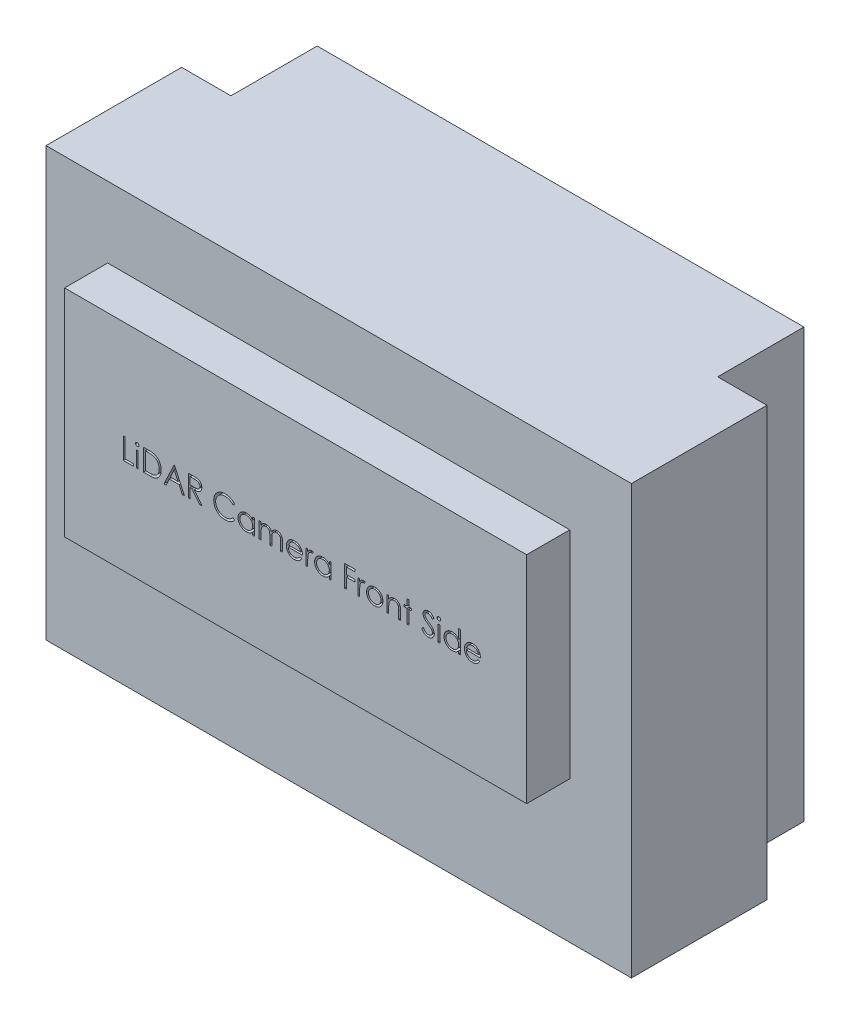
from build123d import *

# Parameters (mm, degrees)
SKETCH1_W                             = 95
SKETCH1_H                             = 69.5
BODY_DEPTH                            = 22
SKETCH2_W                             = 75
SKETCH2_H                             = 35
CAMERA_POP_OUT_DEPTH                  = 7
SKETCH3_W                             = 79
SKETCH3_H                             = 69.5
BACK_SIDE_DEPTH                       = 14
TEXT_2_W                              = 0.314102564
TEXT_2_H                              = 2.557692308
TEXT_2_W_2                            = 0.314102565
CUT_EXTRUDE1_DEPTH                    = 2
F_1_4_0_25_DIAMETER_HOLE1_D           = 6.35
F_1_4_0_25_DIAMETER_HOLE1_DEPTH       = 15.4
F_1_4_0_25_DIAMETER_HOLE1_CSINK_D     = 7.62
F_1_4_0_25_DIAMETER_HOLE1_CSINK_ANGLE = 90
F_1_4_0_25_DIAMETER_HOLE1_TIP         = 1.907732465


with BuildPart() as part:
    # Sketch1 → Body (new body)
    with BuildSketch(Plane.XY):
        with Locations((47.5, 34.75)):
            Rectangle(SKETCH1_W, SKETCH1_H)
    extrude(amount=BODY_DEPTH)

    # Sketch2 → Camera Pop Out (add)
    with BuildSketch(Plane.XY.offset(22)):
        with Locations((47.5, 40.5)):
            Rectangle(SKETCH2_W, SKETCH2_H)
    extrude(amount=CAMERA_POP_OUT_DEPTH)

    # Sketch3 → back side (add)
    with BuildSketch(Plane(origin=(0, 0, 0), x_dir=(-1, 0, 0), z_dir=(0, 0, -1))):
        with Locations((-47.5, 34.75)):
            Rectangle(SKETCH3_W, SKETCH3_H)
    extrude(amount=BACK_SIDE_DEPTH)

    # Text 2 → Cut-Extrude1 (cut)
    # profile 1 of 22: a face of its own
    with BuildSketch(Plane.XY.offset(29)):
        Polygon((19.535649265, 42.013320355), (19.849751829, 42.013320355), (19.849751829, 38.872294714), (21.195905676, 38.872294714), (21.195905676, 38.513320355), (19.535649265, 38.513320355), align=None)
    # profile 2 of 22: a face of its own
    with BuildSketch(Plane.XY.offset(29)):
        with BuildLine():
            add(Edge.make_bspline(
                [(21.800272663, 42.14793574), (21.819763979, 42.147031588), (21.857931718, 42.145261084), (21.913124986, 42.130099607), (21.963381998, 42.104399921), (22.007959731, 42.06992024), (22.046211618, 42.029370797), (22.072992328, 41.982109828), (22.090204724, 41.93105119), (22.09228328, 41.8954361), (22.093341573, 41.877302727)],
                knots=[0, 0, 0, 0, 1.055194115, 2.066272739, 3.074728998, 4.095836921, 5.109056067, 6.073838105, 7.019297344, 8, 8, 8, 8], degree=3))
            add(Edge.make_bspline(
                [(22.093341573, 41.877302727), (22.092259413, 41.859640074), (22.090120111, 41.824723099), (22.073005623, 41.774549627), (22.045983385, 41.727945343), (22.00798426, 41.687474633), (21.963375499, 41.653014013), (21.913126713, 41.627309274), (21.857931264, 41.612149137), (21.819763825, 41.610378448), (21.800272663, 41.609474202)],
                knots=[0, 0, 0, 0, 0.96129708, 1.900370562, 2.859976407, 3.87933698, 4.906634145, 5.921202961, 6.938410037, 8, 8, 8, 8], degree=3))
            add(Edge.make_bspline(
                [(21.800272663, 41.609474202), (21.781004388, 41.610343922), (21.743501207, 41.612036719), (21.689134365, 41.627606736), (21.639305876, 41.653022809), (21.594641203, 41.687248995), (21.55741101, 41.728193892), (21.530312685, 41.774521186), (21.513237723, 41.82473034), (21.511093094, 41.859642507), (21.51000824, 41.877302727)],
                knots=[0, 0, 0, 0, 1.054934014, 2.053291228, 3.073705704, 4.106921865, 5.123545215, 6.088680038, 7.033164197, 8, 8, 8, 8], degree=3))
            add(Edge.make_bspline(
                [(21.51000824, 41.877302727), (21.511069326, 41.895433577), (21.513153367, 41.931043709), (21.530325484, 41.982138742), (21.557185291, 42.029120244), (21.594665855, 42.070145744), (21.639299315, 42.104391178), (21.68913606, 42.12980216), (21.74350076, 42.145373499), (21.781004236, 42.147066114), (21.800272663, 42.14793574)],
                knots=[0, 0, 0, 0, 0.98631895, 1.937192651, 2.907499808, 3.917963147, 4.944918757, 5.95915025, 6.951458133, 8, 8, 8, 8], degree=3))
        make_face()
    # profile 3 of 22: a face of its own
    with BuildSketch(Plane.XY.offset(29)):
        with Locations((21.801674906, 39.792166509)):
            Rectangle(TEXT_2_W, TEXT_2_H)
    # profile 4 of 22: a face of its own
    with BuildSketch(Plane.XY.offset(29)):
        with BuildLine():
            Line((22.811290291, 38.513320355), (22.811290291, 42.013320355))
            Line((22.811290291, 42.013320355), (23.51802106, 42.013320355))
            add(Edge.make_bspline(
                [(23.51802106, 42.013320355), (23.579490048, 42.012877785), (23.698247814, 42.012022742), (23.869860261, 42.006601351), (24.028644024, 41.997010885), (24.174076883, 41.983041359), (24.306558095, 41.965888326), (24.425716703, 41.944387921), (24.532168846, 41.918999751), (24.597638286, 41.897354301), (24.628597983, 41.887118432)],
                knots=[0, 0, 0, 0, 1.314313732, 2.53924729, 3.670748893, 4.714932338, 5.66265055, 6.526160246, 7.303039223, 8, 8, 8, 8], degree=3))
            add(Edge.make_bspline(
                [(24.628597983, 41.887118432), (24.669092723, 41.871687727), (24.749163915, 41.841176233), (24.863171037, 41.783619931), (24.9704964, 41.71840683), (25.071715545, 41.645450967), (25.164516372, 41.562686618), (25.252524268, 41.473629533), (25.332138992, 41.375041193), (25.405047288, 41.268966205), (25.470782948, 41.156654152), (25.527922106, 41.038319044), (25.575376099, 40.914561836), (25.614769326, 40.785726688), (25.645815783, 40.65153031), (25.666997715, 40.511816444), (25.680968705, 40.367137254), (25.682372756, 40.268962791), (25.683085163, 40.219149682)],
                knots=[0, 0, 0, 0, 0.984719456, 1.947108742, 2.898477687, 3.838006223, 4.779231079, 5.722358779, 6.681677486, 7.655904652, 8.64651281, 9.637519902, 10.640069247, 11.656948941, 12.698408672, 13.768548281, 14.867775369, 16, 16, 16, 16], degree=3))
            add(Edge.make_bspline(
                [(25.683085163, 40.219149682), (25.682456195, 40.175888444), (25.681216749, 40.090637655), (25.670087433, 39.964996759), (25.653911113, 39.843083188), (25.628866915, 39.725477488), (25.598464402, 39.61114927), (25.559500251, 39.501317026), (25.514864755, 39.394973216), (25.462814876, 39.29355574), (25.405673491, 39.197472368), (25.344351748, 39.10689684), (25.278915052, 39.023121618), (25.208739419, 38.945893006), (25.134731703, 38.875327428), (25.056407372, 38.810835412), (24.973564322, 38.753678858), (24.886573599, 38.701611749), (24.79289747, 38.656191394), (24.690761604, 38.617761384), (24.579730426, 38.585914769), (24.460076469, 38.559343873), (24.331592991, 38.53826657), (24.194154025, 38.524140178), (24.047970735, 38.514587245), (23.94759147, 38.513750852), (23.895925708, 38.513320355)],
                knots=[0, 0, 0, 0, 1.105936401, 2.179363191, 3.223086493, 4.248585256, 5.251745608, 6.245858792, 7.225916811, 8.198733463, 9.158002045, 10.082870192, 10.993790845, 11.873723703, 12.748670949, 13.606408763, 14.465103618, 15.319838547, 16.196477973, 17.123216899, 18.106603292, 19.147568657, 20.255746949, 21.433717677, 22.679120308, 24, 24, 24, 24], degree=3))
            Line((23.895925708, 38.513320355), (22.811290291, 38.513320355))
        make_face()
        with BuildLine():
            Line((23.125392855, 38.872294714), (23.527135644, 38.872294714))
            add(Edge.make_bspline(
                [(23.527135644, 38.872294714), (23.584864014, 38.872542811), (23.695896813, 38.873019991), (23.85555481, 38.877207194), (24.001434206, 38.884049132), (24.133555716, 38.893624209), (24.25184474, 38.906292825), (24.35654849, 38.920417727), (24.447323748, 38.938015178), (24.502253185, 38.953966137), (24.527636445, 38.961337182)],
                knots=[0, 0, 0, 0, 1.375205317, 2.645023457, 3.804390687, 4.853969522, 5.800190428, 6.637939096, 7.370582563, 8, 8, 8, 8], degree=3))
            add(Edge.make_bspline(
                [(24.527636445, 38.961337182), (24.559584807, 38.972588741), (24.622718445, 38.994823114), (24.71359953, 39.035380775), (24.798356535, 39.083422845), (24.87846656, 39.136825119), (24.952793216, 39.197471121), (25.022217332, 39.26404211), (25.086599133, 39.336876885), (25.145273441, 39.415885046), (25.197781745, 39.500574842), (25.243252975, 39.590113676), (25.283104506, 39.683520486), (25.314383099, 39.782229644), (25.338898683, 39.885358703), (25.356263371, 39.992914916), (25.367078096, 40.104878198), (25.368339544, 40.181030322), (25.368982599, 40.219850804)],
                knots=[0, 0, 0, 0, 0.998632004, 1.973411704, 2.929992603, 3.868527914, 4.809262121, 5.754881198, 6.702106254, 7.672490631, 8.653608572, 9.636854334, 10.631411391, 11.644891563, 12.686317036, 13.754757253, 14.855430412, 16, 16, 16, 16], degree=3))
            add(Edge.make_bspline(
                [(25.368982599, 40.219850804), (25.368469311, 40.260784284), (25.367460954, 40.341198469), (25.354786643, 40.459189164), (25.336265088, 40.572669815), (25.309481402, 40.68164801), (25.275350523, 40.786336362), (25.232755881, 40.886155872), (25.184089262, 40.982160741), (25.126185925, 41.072135107), (25.062770332, 41.157228216), (24.992392452, 41.235183132), (24.916170414, 41.306177432), (24.834935564, 41.371316745), (24.746398465, 41.427980421), (24.652644774, 41.478667102), (24.552299103, 41.521682993), (24.482486407, 41.544561856), (24.447007438, 41.556188945)],
                knots=[0, 0, 0, 0, 1.122418816, 2.205001699, 3.251619955, 4.274784885, 5.280384055, 6.268708349, 7.249350384, 8.229342522, 9.199999885, 10.157847722, 11.105861043, 12.055065948, 13.010012805, 13.98527497, 14.976112212, 16, 16, 16, 16], degree=3))
            add(Edge.make_bspline(
                [(24.447007438, 41.556188945), (24.417656292, 41.564305373), (24.355247702, 41.581563126), (24.253408238, 41.600388498), (24.138793088, 41.616992997), (24.010893387, 41.631051036), (23.869854928, 41.641138358), (23.71556924, 41.648709672), (23.547969636, 41.653816305), (23.431787102, 41.654165012), (23.371486605, 41.654345996)],
                knots=[0, 0, 0, 0, 0.674548936, 1.434276114, 2.292660221, 3.240891867, 4.284742987, 5.42552168, 6.663806718, 8, 8, 8, 8], degree=3))
            Line((23.371486605, 41.654345996), (23.125392855, 41.654345996))
            Line((23.125392855, 41.654345996), (23.125392855, 38.872294714))
        make_face(mode=Mode.SUBTRACT)
    # profile 5 of 22: a face of its own
    with BuildSketch(Plane.XY.offset(29)):
        Polygon((27.836931317, 42.013320355), (29.452315932, 38.513320355), (29.110869618, 38.513320355), (28.593441733, 39.635115227), (27.006803112, 39.635115227), (26.474651669, 38.513320355), (26.131803112, 38.513320355), (27.792059522, 42.013320355), align=None)
        Polygon((27.81098981, 41.331128849), (27.177175708, 39.994089586), (28.42797699, 39.994089586), align=None, mode=Mode.SUBTRACT)
    # profile 6 of 22: a face of its own
    with BuildSketch(Plane.XY.offset(29)):
        with BuildLine():
            Line((30.08052106, 42.013320355), (30.780941733, 42.013320355))
            add(Edge.make_bspline(
                [(30.780941733, 42.013320355), (30.827682862, 42.013164769), (30.917431006, 42.012866027), (31.046004277, 42.011200264), (31.162831374, 42.006425908), (31.267851213, 42.002317325), (31.361061868, 41.994825384), (31.442749159, 41.987664737), (31.512536856, 41.978291076), (31.554782707, 41.969585653), (31.573910483, 41.965644073)],
                knots=[0, 0, 0, 0, 1.410062039, 2.707475311, 3.878576406, 4.937260626, 5.877586885, 6.699081471, 7.410979367, 8, 8, 8, 8], degree=3))
            add(Edge.make_bspline(
                [(31.573910483, 41.965644073), (31.599517107, 41.959317308), (31.650184097, 41.946798744), (31.723134163, 41.920339144), (31.792648487, 41.889719519), (31.858438311, 41.853755799), (31.920174102, 41.812181019), (31.978492413, 41.765712896), (32.033657877, 41.714605691), (32.083439507, 41.657570849), (32.130378558, 41.59773434), (32.169967185, 41.533030583), (32.204093665, 41.465369055), (32.231264182, 41.394061637), (32.253142155, 41.319799866), (32.268568395, 41.241911069), (32.277819582, 41.160750094), (32.278761438, 41.105392185), (32.279239009, 41.077322759)],
                knots=[0, 0, 0, 0, 1.027469482, 2.033020251, 3.019912614, 3.986113645, 4.951240523, 5.91722682, 6.890402269, 7.87763091, 8.8651537, 9.85103654, 10.82876324, 11.815024772, 12.821070561, 13.842952187, 14.906261191, 16, 16, 16, 16], degree=3))
            add(Edge.make_bspline(
                [(32.279239009, 41.077322759), (32.277770011, 41.030687655), (32.274903615, 40.939690487), (32.248178511, 40.807629605), (32.204401992, 40.684440291), (32.144078703, 40.570277653), (32.067259227, 40.467367007), (31.974934436, 40.376976552), (31.867052824, 40.30133664), (31.766623508, 40.248883835), (31.677909309, 40.215290926), (31.604875996, 40.191654567), (31.525209018, 40.173392602), (31.439671684, 40.15703247), (31.347908028, 40.144680776), (31.250137989, 40.135634181), (31.146291837, 40.129980133), (31.074952768, 40.129138128), (31.038253432, 40.128704971)],
                knots=[0, 0, 0, 0, 1.260483769, 2.459530307, 3.627416485, 4.787058657, 5.939039949, 7.08810263, 8.267026773, 9.491475466, 10.141966685, 10.831826277, 11.566392101, 12.351337768, 13.187381173, 14.07005841, 15.007169909, 16, 16, 16, 16], degree=3))
            Line((31.038253432, 40.128704971), (32.324110804, 38.513320355))
            Line((32.324110804, 38.513320355), (31.935689329, 38.513320355))
            Line((31.935689329, 38.513320355), (30.649831958, 40.128704971))
            Line((30.649831958, 40.128704971), (30.394623624, 40.128704971))
            Line((30.394623624, 40.128704971), (30.394623624, 38.513320355))
            Line((30.394623624, 38.513320355), (30.08052106, 38.513320355))
            Line((30.08052106, 38.513320355), (30.08052106, 42.013320355))
        make_face()
        with BuildLine():
            Line((30.394623624, 41.654345996), (30.394623624, 40.48767933))
            Line((30.394623624, 40.48767933), (31.035448945, 40.482771477))
            add(Edge.make_bspline(
                [(31.035448945, 40.482771477), (31.065368984, 40.482758241), (31.123362541, 40.482732584), (31.207263206, 40.48672636), (31.285383317, 40.491269679), (31.35742407, 40.498219024), (31.423417645, 40.507175096), (31.483331058, 40.51837808), (31.53726211, 40.531430143), (31.600160648, 40.551631769), (31.67039718, 40.583637787), (31.74672864, 40.630203286), (31.811730977, 40.688772405), (31.86664884, 40.755745861), (31.910778271, 40.82938211), (31.941890326, 40.908798479), (31.961632768, 40.991990077), (31.963961313, 41.049168185), (31.965136445, 41.078023881)],
                knots=[0, 0, 0, 0, 1.146690395, 2.22261258, 3.21895312, 4.145990853, 4.996080663, 5.770904154, 6.481378293, 7.121626537, 8.300444488, 9.431385265, 10.535395872, 11.636531494, 12.74115979, 13.810798291, 14.895190096, 16, 16, 16, 16], degree=3))
            add(Edge.make_bspline(
                [(31.965136445, 41.078023881), (31.963934324, 41.106170455), (31.961552158, 41.161946693), (31.94210339, 41.243602604), (31.909214009, 41.320669554), (31.864891771, 41.392834039), (31.810892616, 41.458339775), (31.747574803, 41.514386928), (31.676669608, 41.560636392), (31.610398409, 41.590190773), (31.551164197, 41.608310626), (31.499734537, 41.62106179), (31.441623059, 41.631306259), (31.376547601, 41.63951432), (31.30478597, 41.646569264), (31.225975319, 41.651321043), (31.140638538, 41.654134907), (31.081491607, 41.654273996), (31.050873624, 41.654345996)],
                knots=[0, 0, 0, 0, 1.101028733, 2.181837193, 3.264309656, 4.369019818, 5.486613113, 6.575447106, 7.666700264, 8.788928104, 9.402425223, 10.0903467, 10.862060571, 11.710948788, 12.657782767, 13.684531032, 14.801375019, 16, 16, 16, 16], degree=3))
            Line((31.050873624, 41.654345996), (30.394623624, 41.654345996))
        make_face(mode=Mode.SUBTRACT)
    # profile 7 of 22: a face of its own
    with BuildSketch(Plane.XY.offset(29)):
        with BuildLine():
            Line((37.618982599, 41.371092791), (37.344142855, 41.160756253))
            add(Edge.make_bspline(
                [(37.344142855, 41.160756253), (37.324536967, 41.184122223), (37.28558952, 41.230539138), (37.222930317, 41.295718683), (37.157628674, 41.356783944), (37.089709553, 41.414025824), (37.017950434, 41.46544259), (36.944089635, 41.513713693), (36.86689159, 41.556981431), (36.760139855, 41.609444417), (36.620492007, 41.664190572), (36.444697168, 41.710093803), (36.261186069, 41.739314979), (36.13598847, 41.74247982), (36.072307919, 41.744089586)],
                knots=[0, 0, 0, 0, 0.757959112, 1.505699292, 2.245454638, 2.979532153, 3.711538275, 4.438200793, 5.171680507, 5.909471876, 7.393775596, 8.890124382, 10.418191784, 12, 12, 12, 12], degree=3))
            add(Edge.make_bspline(
                [(36.072307919, 41.744089586), (36.03722462, 41.743685624), (35.967383627, 41.742881448), (35.863735154, 41.732272323), (35.762022103, 41.717361113), (35.662310636, 41.695235789), (35.564727678, 41.66726317), (35.468635276, 41.633837756), (35.375424676, 41.592482916), (35.283806438, 41.546774657), (35.196027227, 41.495147212), (35.112972179, 41.43883386), (35.034944211, 41.378464763), (34.961881599, 41.313813657), (34.893709651, 41.245171697), (34.83092234, 41.171807355), (34.77373693, 41.093955181), (34.721019905, 41.012641774), (34.673807171, 40.928103982), (34.634277292, 40.840028912), (34.59927217, 40.749924809), (34.571572927, 40.656773648), (34.54964841, 40.561230882), (34.534520747, 40.463040094), (34.524032276, 40.362406415), (34.523232099, 40.294197102), (34.522828753, 40.259814746)],
                knots=[0, 0, 0, 0, 1.054917814, 2.100044995, 3.131103042, 4.146048494, 5.169673617, 6.183595914, 7.203665975, 8.234915748, 9.262203917, 10.264457458, 11.251630812, 12.227803204, 13.197192746, 14.159520551, 15.12972552, 16.100847026, 17.073214652, 18.039054194, 19.002613845, 19.979014051, 20.95965708, 21.949030935, 22.966165397, 24, 24, 24, 24], degree=3))
            add(Edge.make_bspline(
                [(34.522828753, 40.259814746), (34.524090572, 40.208083427), (34.526567986, 40.106515842), (34.54861632, 39.957745231), (34.582121411, 39.815224557), (34.632336988, 39.679844715), (34.694256039, 39.549936357), (34.77249665, 39.427697504), (34.863113188, 39.311280939), (34.967387607, 39.203437991), (35.081793423, 39.104924266), (35.204541335, 39.018173684), (35.335325622, 38.945858802), (35.472702253, 38.885682856), (35.617728367, 38.839426128), (35.770143169, 38.806862004), (35.929615164, 38.785619824), (36.038584564, 38.783586136), (36.094042695, 38.782551125)],
                knots=[0, 0, 0, 0, 1.029171465, 2.020641659, 2.987623507, 3.938342917, 4.889210282, 5.84687017, 6.821220943, 7.821438502, 8.827599549, 9.822697543, 10.807740252, 11.797342354, 12.80366471, 13.83203677, 14.896651826, 16, 16, 16, 16], degree=3))
            add(Edge.make_bspline(
                [(36.094042695, 38.782551125), (36.155145384, 38.784239904), (36.275410093, 38.787563827), (36.451778119, 38.815723076), (36.620613885, 38.861380994), (36.781926471, 38.925278916), (36.935261117, 39.008344204), (37.080857778, 39.109042082), (37.218839348, 39.228330414), (37.301810631, 39.319413543), (37.344142855, 39.365884458)],
                knots=[0, 0, 0, 0, 1.028121516, 2.023589091, 2.998037872, 3.967518031, 4.937445131, 5.927275754, 6.942489185, 8, 8, 8, 8], degree=3))
            Line((37.344142855, 39.365884458), (37.618982599, 39.157651285))
            add(Edge.make_bspline(
                [(37.618982599, 39.157651285), (37.596864489, 39.129112833), (37.552734214, 39.072172627), (37.481276197, 38.991900917), (37.405998899, 38.916396881), (37.326343189, 38.84626926), (37.243225398, 38.780114795), (37.155153085, 38.719812963), (37.063284053, 38.664522079), (36.967929574, 38.613895155), (36.869190961, 38.568977908), (36.767186526, 38.53052414), (36.662355951, 38.49739925), (36.554694442, 38.470147314), (36.443978685, 38.44887623), (36.330608211, 38.434656555), (36.214338336, 38.42491464), (36.135896915, 38.424026725), (36.09614606, 38.423576766)],
                knots=[0, 0, 0, 0, 0.986787822, 1.968848986, 2.935600012, 3.899624008, 4.868462664, 5.837806735, 6.815139263, 7.798259679, 8.787526145, 9.778297419, 10.776456485, 11.791383307, 12.812564526, 13.85620153, 14.913611965, 16, 16, 16, 16], degree=3))
            add(Edge.make_bspline(
                [(36.09614606, 38.423576766), (36.058502393, 38.423838758), (35.984066703, 38.424356816), (35.874167951, 38.432748983), (35.767178371, 38.44419872), (35.663403745, 38.461438851), (35.56227777, 38.481783191), (35.464717185, 38.509054448), (35.369761975, 38.539603615), (35.277793634, 38.575508601), (35.188733934, 38.616024784), (35.102870123, 38.661816343), (35.020241691, 38.712498208), (34.94003627, 38.766953218), (34.863438686, 38.82693052), (34.789785161, 38.891597154), (34.718662685, 38.960735165), (34.67466, 39.010590018), (34.652536285, 39.035656093)],
                knots=[0, 0, 0, 0, 1.114604814, 2.203992996, 3.262667896, 4.300477797, 5.318619304, 6.316056647, 7.298880507, 8.271930387, 9.238335007, 10.195173496, 11.151986948, 12.108099108, 13.064862484, 14.031167946, 15.010108607, 16, 16, 16, 16], degree=3))
            add(Edge.make_bspline(
                [(34.652536285, 39.035656093), (34.617100641, 39.079197282), (34.546657164, 39.165753992), (34.456531481, 39.306039973), (34.379383925, 39.452508182), (34.317008005, 39.605928111), (34.268245272, 39.765955498), (34.234464076, 39.932671012), (34.212512472, 40.105918955), (34.210002183, 40.223755743), (34.208726188, 40.283652887)],
                knots=[0, 0, 0, 0, 0.994628077, 1.977248131, 2.950237994, 3.925870899, 4.908910175, 5.911660606, 6.938484602, 8, 8, 8, 8], degree=3))
            add(Edge.make_bspline(
                [(34.208726188, 40.283652887), (34.210281382, 40.346608341), (34.213341128, 40.470469266), (34.239336924, 40.652243219), (34.28115572, 40.826394618), (34.340552608, 40.992598362), (34.41585796, 41.151728643), (34.508884574, 41.302569847), (34.618551716, 41.446086647), (34.743999284, 41.580101398), (34.881566619, 41.702640751), (35.028885433, 41.810446955), (35.18566738, 41.900164471), (35.350185231, 41.975160633), (35.523670913, 42.032805096), (35.705754282, 42.073158283), (35.896093197, 42.098275399), (36.025955622, 42.101450607), (36.091939329, 42.103063945)],
                knots=[0, 0, 0, 0, 1.032925535, 2.032216505, 3.007276963, 3.968222605, 4.92396291, 5.891752235, 6.871517503, 7.883894988, 8.900124299, 9.891468569, 10.874487609, 11.85992873, 12.854644235, 13.869047385, 14.917252991, 16, 16, 16, 16], degree=3))
            add(Edge.make_bspline(
                [(36.091939329, 42.103063945), (36.132153801, 42.102581807), (36.211754299, 42.101627463), (36.329506951, 42.092321321), (36.444149278, 42.076807715), (36.55576026, 42.055691645), (36.664882876, 42.029484323), (36.770683117, 41.995344025), (36.873781804, 41.956307494), (36.973528712, 41.911349028), (37.069445262, 41.860882286), (37.161501581, 41.805466663), (37.24896644, 41.745170857), (37.332455288, 41.680507682), (37.410571499, 41.610109123), (37.485532978, 41.535911527), (37.554794056, 41.455777702), (37.597547251, 41.399372769), (37.618982599, 41.371092791)],
                knots=[0, 0, 0, 0, 1.096760587, 2.17092713, 3.219439832, 4.250915756, 5.268269357, 6.278326846, 7.281116186, 8.274029601, 9.260640565, 10.235837813, 11.203064059, 12.156899882, 13.114053108, 14.069676657, 15.032185724, 16, 16, 16, 16], degree=3))
        make_face()
    # profile 8 of 22: a face of its own
    with BuildSketch(Plane.XY.offset(29)):
        with BuildLine():
            Line((40.849751829, 41.071012663), (40.849751829, 38.513320355))
            Line((40.849751829, 38.513320355), (40.535649265, 38.513320355))
            Line((40.535649265, 38.513320355), (40.535649265, 38.955728208))
            add(Edge.make_bspline(
                [(40.535649265, 38.955728208), (40.500230475, 38.915688614), (40.431110259, 38.837550843), (40.315669141, 38.73546867), (40.193300964, 38.651090349), (40.064599642, 38.582940433), (39.929681399, 38.531748377), (39.788845312, 38.495362218), (39.642033931, 38.471968383), (39.541781576, 38.469632361), (39.490977791, 38.468448561)],
                knots=[0, 0, 0, 0, 1.074387032, 2.096679803, 3.090159297, 4.057316773, 5.018401886, 5.985159533, 6.978961417, 8, 8, 8, 8], degree=3))
            add(Edge.make_bspline(
                [(39.490977791, 38.468448561), (39.445809837, 38.469674933), (39.356736632, 38.472093393), (39.225707555, 38.490855697), (39.099615306, 38.520986318), (38.978340733, 38.562887208), (38.862668588, 38.61846803), (38.751608491, 38.685009278), (38.645735799, 38.764250108), (38.54666426, 38.854838136), (38.45543226, 38.953233123), (38.375370987, 39.05817867), (38.308617907, 39.169220974), (38.252797826, 39.284954128), (38.209801482, 39.406269047), (38.179827848, 39.532746215), (38.161087401, 39.664236089), (38.15866994, 39.753775612), (38.157444137, 39.799177727)],
                knots=[0, 0, 0, 0, 1.033919861, 2.038935746, 3.024066025, 3.998881131, 4.97069526, 5.957263378, 6.95902576, 7.993208707, 9.027059324, 10.027763471, 11.009749337, 11.988697705, 12.965288445, 13.950418724, 14.960734635, 16, 16, 16, 16], degree=3))
            add(Edge.make_bspline(
                [(38.157444137, 39.799177727), (38.158697109, 39.843641431), (38.161174165, 39.931543774), (38.179627385, 40.060822472), (38.210658394, 40.185340733), (38.254206242, 40.304697676), (38.310048196, 40.419037726), (38.377976284, 40.528441751), (38.457995408, 40.633211149), (38.550247815, 40.730882375), (38.650182585, 40.82110299), (38.757091316, 40.899512035), (38.868314598, 40.967228884), (38.985577608, 41.02088236), (39.107144713, 41.064291465), (39.234098159, 41.094324433), (39.365909737, 41.112021754), (39.455400229, 41.114584518), (39.500793496, 41.115884458)],
                knots=[0, 0, 0, 0, 1.020392517, 2.01726096, 2.990465484, 3.961182959, 4.928053699, 5.906110375, 6.912531644, 7.948652711, 8.985773172, 9.998621852, 10.987621588, 11.969261332, 12.953316658, 13.946091881, 14.958173133, 16, 16, 16, 16], degree=3))
            add(Edge.make_bspline(
                [(39.500793496, 41.115884458), (39.552993355, 41.114446706), (39.655354815, 41.111627344), (39.805082824, 41.088164616), (39.946727302, 41.048526149), (40.081381654, 40.994608651), (40.20856234, 40.922959922), (40.327065325, 40.832579961), (40.438130808, 40.724038774), (40.5025111, 40.640668329), (40.535649265, 40.597755452)],
                knots=[0, 0, 0, 0, 1.038897134, 2.037228247, 3.008116434, 3.962042015, 4.918381754, 5.904844433, 6.921570401, 8, 8, 8, 8], degree=3))
            Line((40.535649265, 40.597755452), (40.535649265, 41.071012663))
            Line((40.535649265, 41.071012663), (40.849751829, 41.071012663))
        make_face()
        with BuildLine():
            add(Edge.make_bspline(
                [(39.505000227, 40.801781894), (39.459085889, 40.800148256), (39.368458289, 40.796923715), (39.235414287, 40.77175022), (39.108100873, 40.729865626), (38.987154799, 40.672583724), (38.874486582, 40.600554988), (38.773792911, 40.513433604), (38.68425021, 40.41359659), (38.608941946, 40.30149448), (38.547551449, 40.181316389), (38.504384417, 40.055691951), (38.475915169, 39.926886973), (38.473006649, 39.839524287), (38.471546701, 39.795672118)],
                knots=[0, 0, 0, 0, 1.031046209, 2.035121221, 3.029706178, 4.034933723, 5.034054252, 6.02443088, 7.017295772, 8.038157696, 9.050218397, 10.03989886, 11.016116709, 12, 12, 12, 12], degree=3))
            add(Edge.make_bspline(
                [(38.471546701, 39.795672118), (38.473411595, 39.752082011), (38.477134071, 39.665072655), (38.503884766, 39.536092078), (38.548764639, 39.410438036), (38.610006702, 39.289177043), (38.686693327, 39.176592942), (38.775581979, 39.07485282), (38.877532261, 38.987363232), (38.990459768, 38.914125658), (39.111067738, 38.854963137), (39.23790167, 38.813797498), (39.368577308, 38.787219717), (39.457429642, 38.78411524), (39.50219574, 38.782551125)],
                knots=[0, 0, 0, 0, 0.979072187, 1.954306742, 2.945804271, 3.96968567, 4.997920485, 5.998718438, 6.996577872, 8.005894225, 9.015743152, 10.005417472, 10.995077863, 12, 12, 12, 12], degree=3))
            add(Edge.make_bspline(
                [(39.50219574, 38.782551125), (39.547642242, 38.784211089), (39.638030829, 38.787512592), (39.771469537, 38.812793857), (39.9009645, 38.854562656), (40.024751728, 38.912461783), (40.140067859, 38.984219138), (40.243565737, 39.068226229), (40.331081705, 39.165929414), (40.405274315, 39.273305867), (40.463449731, 39.391017863), (40.505825791, 39.516352054), (40.530879696, 39.649312802), (40.534037426, 39.740176729), (40.535649265, 39.786557535)],
                knots=[0, 0, 0, 0, 1.01762866, 2.023962475, 3.030623092, 4.058876274, 5.077231937, 6.066672613, 7.034107872, 8.005628644, 8.981990164, 9.965428785, 10.961468474, 12, 12, 12, 12], degree=3))
            add(Edge.make_bspline(
                [(40.535649265, 39.786557535), (40.534689609, 39.821895365), (40.532800702, 39.891451399), (40.518370132, 39.993578916), (40.495415206, 40.091312642), (40.463069036, 40.184755331), (40.420577751, 40.273390347), (40.369329985, 40.357854107), (40.308424536, 40.437707318), (40.238841839, 40.511850389), (40.162676637, 40.579476852), (40.082082096, 40.639841092), (39.996103349, 40.689429865), (39.906186312, 40.730471137), (39.812174978, 40.763130286), (39.713304358, 40.78491798), (39.610625371, 40.799878301), (39.540579316, 40.801140682), (39.505000227, 40.801781894)],
                knots=[0, 0, 0, 0, 1.050140795, 2.067009409, 3.05949893, 4.030605086, 5.00011959, 5.97591094, 6.962425594, 7.979863591, 8.993523472, 9.986985069, 10.967611495, 11.937549037, 12.921786183, 13.919465291, 14.943216303, 16, 16, 16, 16], degree=3))
        make_face(mode=Mode.SUBTRACT)
    # profile 9 of 22: a face of its own
    with BuildSketch(Plane.XY.offset(29)):
        with BuildLine():
            Line((41.567700547, 41.071012663), (41.881803112, 41.071012663))
            Line((41.881803112, 41.071012663), (41.881803112, 40.626501445))
            add(Edge.make_bspline(
                [(41.881803112, 40.626501445), (41.910087061, 40.665389047), (41.964281821, 40.73990142), (42.053147474, 40.838091704), (42.141923586, 40.921419859), (42.205856968, 40.96516273), (42.23657074, 40.986176926)],
                knots=[0, 0, 0, 0, 1.134379233, 2.173579362, 3.122582517, 4, 4, 4, 4], degree=3))
            add(Edge.make_bspline(
                [(42.23657074, 40.986176926), (42.278435402, 41.006182291), (42.361433302, 41.045843505), (42.492852527, 41.086077063), (42.627327196, 41.110802165), (42.71813541, 41.114183538), (42.763814329, 41.115884458)],
                knots=[0, 0, 0, 0, 1.014936303, 2.012140481, 3.000054389, 4, 4, 4, 4], degree=3))
            add(Edge.make_bspline(
                [(42.763814329, 41.115884458), (42.794707326, 41.114839167), (42.855842905, 41.112770593), (42.946426995, 41.099310558), (43.034285607, 41.076044385), (43.118899636, 41.043637061), (43.198620316, 41.004390374), (43.271709513, 40.958340666), (43.337333722, 40.906643591), (43.395459773, 40.846964658), (43.447728798, 40.777628059), (43.495807645, 40.69676381), (43.540232857, 40.602556149), (43.564854166, 40.534189608), (43.577816733, 40.498196157)],
                knots=[0, 0, 0, 0, 1.009824226, 1.998387844, 2.986035974, 3.974953746, 4.955485308, 5.885931332, 6.793869504, 7.679848016, 8.601185859, 9.625726857, 10.749998409, 12, 12, 12, 12], degree=3))
            add(Edge.make_bspline(
                [(43.577816733, 40.498196157), (43.591527985, 40.522920576), (43.618509802, 40.571574761), (43.663815439, 40.640433023), (43.711283235, 40.704839815), (43.761317728, 40.764846239), (43.813742315, 40.82015597), (43.868803716, 40.870951871), (43.926188497, 40.917452085), (44.005980737, 40.971775245), (44.109793344, 41.029476426), (44.240681459, 41.07950487), (44.376831631, 41.110420998), (44.469249329, 41.114051271), (44.515917695, 41.115884458)],
                knots=[0, 0, 0, 0, 0.86119277, 1.694706429, 2.50939023, 3.298075842, 4.073795165, 4.829715201, 5.57930267, 6.321991688, 7.768977793, 9.186738141, 10.579381044, 12, 12, 12, 12], degree=3))
            add(Edge.make_bspline(
                [(44.515917695, 41.115884458), (44.558799158, 41.114267237), (44.642722344, 41.111102179), (44.76489961, 41.086248706), (44.878841415, 41.043571058), (44.984318491, 40.985337422), (45.079478304, 40.912158239), (45.162194614, 40.825089401), (45.231964977, 40.724746778), (45.277543617, 40.630354789), (45.308458881, 40.547019456), (45.327520115, 40.476013165), (45.34435981, 40.397861612), (45.358341056, 40.312471351), (45.368559608, 40.219540742), (45.376130323, 40.119221866), (45.381254397, 40.011436755), (45.381616469, 39.937071255), (45.381803112, 39.898737022)],
                knots=[0, 0, 0, 0, 1.209669288, 2.367440248, 3.500751976, 4.631527125, 5.755587489, 6.87532382, 8.007944318, 9.190864318, 9.82315674, 10.514484317, 11.263564316, 12.079023757, 12.955305781, 13.901327259, 14.918167583, 16, 16, 16, 16], degree=3))
            Line((45.381803112, 39.898737022), (45.381803112, 38.513320355))
            Line((45.381803112, 38.513320355), (45.067700547, 38.513320355))
            Line((45.067700547, 38.513320355), (45.067700547, 39.900139266))
            add(Edge.make_bspline(
                [(45.067700547, 39.900139266), (45.067622664, 39.93285984), (45.067472985, 39.995743806), (45.064779354, 40.085996258), (45.05970404, 40.168264615), (45.053769401, 40.242436703), (45.045525591, 40.308685492), (45.03487966, 40.36687791), (45.02360198, 40.417471721), (45.004865989, 40.473557769), (44.974918097, 40.53542798), (44.929300617, 40.602151555), (44.871830511, 40.660232356), (44.805470354, 40.710650672), (44.72992191, 40.751644313), (44.646657186, 40.780920323), (44.556193135, 40.799043202), (44.493570346, 40.800849217), (44.461230195, 40.801781894)],
                knots=[0, 0, 0, 0, 1.253487763, 2.409012846, 3.458416907, 4.410876679, 5.259312806, 6.014470957, 6.676830364, 7.243083969, 8.276244668, 9.299465089, 10.325150304, 11.392391894, 12.482080715, 13.603491619, 14.762376348, 16, 16, 16, 16], degree=3))
            add(Edge.make_bspline(
                [(44.461230195, 40.801781894), (44.42156024, 40.800365736), (44.343157329, 40.797566871), (44.228711843, 40.768992998), (44.118740826, 40.725912747), (44.016525694, 40.66348029), (43.922497903, 40.588671927), (43.841598325, 40.499722331), (43.774766139, 40.399092404), (43.729512164, 40.305945702), (43.700922862, 40.222276258), (43.682045947, 40.149178886), (43.667362555, 40.066097318), (43.653592026, 39.973589827), (43.644604298, 39.871019647), (43.636435926, 39.758861246), (43.632615063, 39.636777286), (43.632080604, 39.552150598), (43.631803112, 39.508212182)],
                knots=[0, 0, 0, 0, 1.090531906, 2.155305635, 3.229839962, 4.33261226, 5.44038871, 6.529323825, 7.629011124, 8.757537029, 9.370236727, 10.061839251, 10.834451254, 11.692844982, 12.636905849, 13.66920014, 14.789842145, 16, 16, 16, 16], degree=3))
            Line((43.631803112, 39.508212182), (43.631803112, 38.513320355))
            Line((43.631803112, 38.513320355), (43.317700547, 38.513320355))
            Line((43.317700547, 38.513320355), (43.317700547, 39.813901285))
            add(Edge.make_bspline(
                [(43.317700547, 39.813901285), (43.317621116, 39.850594604), (43.317468299, 39.921188861), (43.314791982, 40.022422536), (43.30970536, 40.114503616), (43.303824812, 40.19732508), (43.295364633, 40.270736409), (43.285754871, 40.335131167), (43.274406261, 40.390347918), (43.255616376, 40.450911303), (43.226901908, 40.517632226), (43.180713646, 40.588773247), (43.123106065, 40.651041344), (43.05553519, 40.704200093), (42.979529507, 40.748141574), (42.895546107, 40.779801326), (42.804341194, 40.798225616), (42.741463488, 40.800574112), (42.709126829, 40.801781894)],
                knots=[0, 0, 0, 0, 1.320475261, 2.540461679, 3.643808994, 4.639130445, 5.527981419, 6.302341397, 6.981980563, 7.553956391, 8.582137848, 9.585246428, 10.591171744, 11.620968678, 12.668337649, 13.738356861, 14.836885341, 16, 16, 16, 16], degree=3))
            add(Edge.make_bspline(
                [(42.709126829, 40.801781894), (42.671110618, 40.800251434), (42.595345659, 40.797201281), (42.484043689, 40.769747008), (42.376558005, 40.726742933), (42.274603307, 40.667083114), (42.180929158, 40.593184035), (42.098920891, 40.506269139), (42.029978365, 40.407420106), (41.984246551, 40.315255589), (41.954748076, 40.233682314), (41.935152742, 40.164331367), (41.918313116, 40.087331118), (41.905799094, 40.002444007), (41.893718679, 39.910222913), (41.88788837, 39.810208424), (41.882216807, 39.702486336), (41.881944393, 39.628113791), (41.881803112, 39.589542311)],
                knots=[0, 0, 0, 0, 1.098833095, 2.189935336, 3.297829714, 4.440610912, 5.596351641, 6.740013378, 7.886572111, 9.072425424, 9.705826452, 10.395263256, 11.156850408, 11.985370555, 12.878090359, 13.847760091, 14.883794034, 16, 16, 16, 16], degree=3))
            Line((41.881803112, 39.589542311), (41.881803112, 38.513320355))
            Line((41.881803112, 38.513320355), (41.567700547, 38.513320355))
            Line((41.567700547, 38.513320355), (41.567700547, 41.071012663))
        make_face()
    # profile 10 of 22: a face of its own
    with BuildSketch(Plane.XY.offset(29)):
        with BuildLine():
            Line((48.198910483, 39.321012663), (48.477956958, 39.174478208))
            add(Edge.make_bspline(
                [(48.477956958, 39.174478208), (48.455720362, 39.135034877), (48.412456754, 39.058293774), (48.338056006, 38.952861913), (48.260063933, 38.858014198), (48.174959965, 38.776284543), (48.085290287, 38.705033158), (47.990557632, 38.642695334), (47.890268814, 38.589576813), (47.784419089, 38.544824285), (47.672119538, 38.510414791), (47.553098022, 38.48611057), (47.427126526, 38.471087302), (47.340780346, 38.469342161), (47.296566733, 38.468448561)],
                knots=[0, 0, 0, 0, 1.120438281, 2.179929193, 3.190490725, 4.156257408, 5.095198341, 6.022838206, 6.959905092, 7.901321166, 8.864066838, 9.862729781, 10.905609505, 12, 12, 12, 12], degree=3))
            add(Edge.make_bspline(
                [(47.296566733, 38.468448561), (47.247424756, 38.469595736), (47.151562994, 38.471833543), (47.012023247, 38.491126007), (46.880643829, 38.522598366), (46.757432125, 38.566563907), (46.642689873, 38.623991231), (46.536189018, 38.693950713), (46.437369492, 38.776082968), (46.349345283, 38.871099411), (46.2701014, 38.972781369), (46.20017558, 39.078737253), (46.141718149, 39.188700478), (46.094165539, 39.301971002), (46.055760674, 39.417834895), (46.02899397, 39.537346363), (46.013564222, 39.660181947), (46.011199777, 39.743279283), (46.01000824, 39.785155291)],
                knots=[0, 0, 0, 0, 1.145258523, 2.234067595, 3.276747158, 4.290159414, 5.277019952, 6.260822364, 7.254936242, 8.264827045, 9.274100331, 10.257902744, 11.220704747, 12.172965371, 13.118907548, 14.062713208, 15.023725156, 16, 16, 16, 16], degree=3))
            add(Edge.make_bspline(
                [(46.01000824, 39.785155291), (46.011067381, 39.824450122), (46.013166459, 39.902327286), (46.026397247, 40.017592831), (46.04984554, 40.129621283), (46.082021864, 40.238505731), (46.12357311, 40.344063865), (46.174405329, 40.446359929), (46.234597707, 40.545285069), (46.281070381, 40.607688203), (46.304479394, 40.639121637)],
                knots=[0, 0, 0, 0, 1.024358464, 2.0301432, 3.019427413, 4.004406732, 4.986367066, 5.972626655, 6.978780325, 8, 8, 8, 8], degree=3))
            add(Edge.make_bspline(
                [(46.304479394, 40.639121637), (46.336187076, 40.676990508), (46.398598023, 40.751528658), (46.504154378, 40.849466984), (46.618454575, 40.931510759), (46.740066201, 40.999517895), (46.870402675, 41.051191542), (47.007711966, 41.089699124), (47.153557552, 41.111277135), (47.253262773, 41.114324969), (47.304279073, 41.115884458)],
                knots=[0, 0, 0, 0, 1.030682036, 2.02871468, 2.997146059, 3.962720338, 4.930598197, 5.918074684, 6.934738563, 8, 8, 8, 8], degree=3))
            add(Edge.make_bspline(
                [(47.304279073, 41.115884458), (47.356726678, 41.114530409), (47.459616924, 41.111874074), (47.609649045, 41.08724774), (47.751609762, 41.048195186), (47.885442266, 40.993041395), (48.011160127, 40.921881844), (48.127946177, 40.833740002), (48.237797689, 40.731321915), (48.301706268, 40.652558705), (48.33422699, 40.612479009)],
                knots=[0, 0, 0, 0, 1.056321875, 2.072262726, 3.055038591, 4.01806755, 4.982017516, 5.957941055, 6.960871419, 8, 8, 8, 8], degree=3))
            add(Edge.make_bspline(
                [(48.33422699, 40.612479009), (48.356353928, 40.582275428), (48.400460521, 40.522069309), (48.455707621, 40.423898152), (48.503665016, 40.321187558), (48.541997977, 40.212277261), (48.573037478, 40.09845768), (48.595494297, 39.978915136), (48.608663916, 39.853685224), (48.611252613, 39.768358669), (48.612572342, 39.724858817)],
                knots=[0, 0, 0, 0, 0.94817472, 1.890038105, 2.849395472, 3.817997239, 4.812318967, 5.836947057, 6.897266129, 8, 8, 8, 8], degree=3))
            Line((48.612572342, 39.724858817), (46.324110804, 39.724858817))
            add(Edge.make_bspline(
                [(46.324110804, 39.724858817), (46.32565041, 39.691158353), (46.328677984, 39.624887749), (46.342793127, 39.527916966), (46.365041901, 39.435543624), (46.396310964, 39.348460582), (46.434177809, 39.265530454), (46.480563526, 39.187368417), (46.53590308, 39.114330487), (46.597628779, 39.04576335), (46.666335874, 38.984702588), (46.738618622, 38.930050812), (46.815512187, 38.884245215), (46.89641027, 38.847065326), (46.981182055, 38.81795901), (47.06985425, 38.798091189), (47.162252367, 38.784784082), (47.225238101, 38.783304417), (47.257303913, 38.782551125)],
                knots=[0, 0, 0, 0, 1.094153842, 2.151609401, 3.174256925, 4.172055639, 5.149267565, 6.128595816, 7.11444997, 8.118368179, 9.117203808, 10.09244225, 11.054858984, 12.015122123, 12.976791628, 13.957293641, 14.960065497, 16, 16, 16, 16], degree=3))
            add(Edge.make_bspline(
                [(47.257303913, 38.782551125), (47.28865506, 38.783159181), (47.350861751, 38.784365682), (47.443502609, 38.796097593), (47.534642136, 38.815067869), (47.623903119, 38.840957859), (47.709473965, 38.872534711), (47.788719515, 38.910637569), (47.861599731, 38.952787315), (47.929716698, 39.000996991), (47.995787691, 39.060005178), (48.061330177, 39.133640899), (48.131606831, 39.220728426), (48.175596423, 39.286274092), (48.198910483, 39.321012663)],
                knots=[0, 0, 0, 0, 0.99110716, 1.966546729, 2.947904876, 3.932708344, 4.903319531, 5.828989031, 6.710028674, 7.56322171, 8.463672341, 9.504779593, 10.677557249, 12, 12, 12, 12], degree=3))
        make_face()
        with BuildLine():
            add(Edge.make_bspline(
                [(48.298469778, 40.038961381), (48.286973154, 40.080624255), (48.264845852, 40.160811875), (48.218609488, 40.271852766), (48.166537947, 40.370540667), (48.104916216, 40.4561203), (48.03509749, 40.532123813), (47.954452307, 40.598542398), (47.864016414, 40.657959849), (47.764257273, 40.708112349), (47.658615488, 40.750802207), (47.548009296, 40.779427323), (47.435151508, 40.799036865), (47.358817222, 40.800862974), (47.320404874, 40.801781894)],
                knots=[0, 0, 0, 0, 1.154881502, 2.222775134, 3.210006277, 4.132804581, 5.035138423, 5.962687519, 6.919655026, 7.923214229, 8.944639381, 9.960483929, 10.97369054, 12, 12, 12, 12], degree=3))
            add(Edge.make_bspline(
                [(47.320404874, 40.801781894), (47.289055436, 40.801170222), (47.227084187, 40.799961076), (47.135783119, 40.788490947), (47.04810342, 40.769531102), (46.963398132, 40.743566145), (46.882777264, 40.708957543), (46.804582495, 40.668374316), (46.730802099, 40.618832733), (46.684660804, 40.581073878), (46.661350387, 40.56199824)],
                knots=[0, 0, 0, 0, 1.04873581, 2.073130211, 3.073294108, 4.04793562, 5.032784715, 6.005352987, 6.992311501, 8, 8, 8, 8], degree=3))
            add(Edge.make_bspline(
                [(46.661350387, 40.56199824), (46.644657105, 40.546903924), (46.610873971, 40.516356708), (46.565733449, 40.463727502), (46.522512977, 40.40697594), (46.483179324, 40.343930815), (46.447101738, 40.275310036), (46.41334176, 40.201692401), (46.382955348, 40.122519271), (46.365859238, 40.067346831), (46.357063528, 40.038961381)],
                knots=[0, 0, 0, 0, 0.879870761, 1.780643979, 2.707998968, 3.669668524, 4.684282772, 5.740141944, 6.837334558, 8, 8, 8, 8], degree=3))
            Line((46.357063528, 40.038961381), (48.298469778, 40.038961381))
        make_face(mode=Mode.SUBTRACT)
    # profile 11 of 22: a face of its own
    with BuildSketch(Plane.XY.offset(29)):
        with BuildLine():
            Line((49.151033881, 41.071012663), (49.465136445, 41.071012663))
            Line((49.465136445, 41.071012663), (49.465136445, 40.694510259))
            add(Edge.make_bspline(
                [(49.465136445, 40.694510259), (49.488325204, 40.729566088), (49.532673525, 40.796610087), (49.606386454, 40.885279388), (49.681889785, 40.958694434), (49.759544972, 41.017197953), (49.839923072, 41.061011072), (49.921260024, 41.093104107), (50.004835494, 41.112081422), (50.060997418, 41.114615081), (50.089134842, 41.115884458)],
                knots=[0, 0, 0, 0, 1.2804753, 2.448899062, 3.506932113, 4.484331642, 5.4025378, 6.288909075, 7.142734305, 8, 8, 8, 8], degree=3))
            add(Edge.make_bspline(
                [(50.089134842, 41.115884458), (50.110961169, 41.114693931), (50.155870254, 41.112244346), (50.223852844, 41.095033521), (50.293896296, 41.067555498), (50.339038683, 41.041715276), (50.362572342, 41.028244234)],
                knots=[0, 0, 0, 0, 0.901110191, 1.854092781, 2.881294221, 4, 4, 4, 4], degree=3))
            Line((50.362572342, 41.028244234), (50.190096381, 40.756208977))
            add(Edge.make_bspline(
                [(50.190096381, 40.756208977), (50.17498736, 40.762949243), (50.146307545, 40.775743559), (50.104352979, 40.790885569), (50.065671642, 40.799801485), (50.041028084, 40.801152202), (50.02953949, 40.801781894)],
                knots=[0, 0, 0, 0, 1.180555205, 2.24091978, 3.179933427, 4, 4, 4, 4], degree=3))
            add(Edge.make_bspline(
                [(50.02953949, 40.801781894), (50.004333756, 40.800101857), (49.952921366, 40.796675067), (49.877436867, 40.769736259), (49.804189661, 40.726211019), (49.746017999, 40.677939908), (49.700975746, 40.63139211), (49.668835521, 40.590743708), (49.639352774, 40.545165076), (49.611182553, 40.495435392), (49.585516259, 40.440705546), (49.56156159, 40.381522333), (49.539902727, 40.317817204), (49.527552483, 40.273434684), (49.521226188, 40.250700163)],
                knots=[0, 0, 0, 0, 1.125678352, 2.296057538, 3.5422874, 4.923748041, 5.663163013, 6.437101912, 7.23742474, 8.08941207, 8.991984279, 9.93940061, 10.944477711, 12, 12, 12, 12], degree=3))
            add(Edge.make_bspline(
                [(49.521226188, 40.250700163), (49.516493795, 40.23042299), (49.506011903, 40.185510591), (49.495820366, 40.110162066), (49.485750848, 40.021138407), (49.478654229, 39.918191815), (49.472076187, 39.801579371), (49.468366105, 39.671123425), (49.465262964, 39.526690074), (49.465179897, 39.425715721), (49.465136445, 39.372895676)],
                knots=[0, 0, 0, 0, 0.566838948, 1.255505196, 2.06880316, 3.007127437, 4.065329342, 5.249902469, 6.561414163, 8, 8, 8, 8], degree=3))
            Line((49.465136445, 39.372895676), (49.465136445, 38.513320355))
            Line((49.465136445, 38.513320355), (49.151033881, 38.513320355))
            Line((49.151033881, 38.513320355), (49.151033881, 41.071012663))
        make_face()
    # profile 12 of 22: a face of its own
    with BuildSketch(Plane.XY.offset(29)):
        with BuildLine():
            Line((53.279239009, 41.071012663), (53.279239009, 38.513320355))
            Line((53.279239009, 38.513320355), (52.965136445, 38.513320355))
            Line((52.965136445, 38.513320355), (52.965136445, 38.955728208))
            add(Edge.make_bspline(
                [(52.965136445, 38.955728208), (52.929717654, 38.915688614), (52.860597439, 38.837550843), (52.745156321, 38.73546867), (52.622788143, 38.651090349), (52.494086822, 38.582940433), (52.359168579, 38.531748377), (52.218332491, 38.495362218), (52.07152111, 38.471968383), (51.971268756, 38.469632361), (51.92046497, 38.468448561)],
                knots=[0, 0, 0, 0, 1.074387032, 2.096679803, 3.090159297, 4.057316773, 5.018401886, 5.985159533, 6.978961417, 8, 8, 8, 8], degree=3))
            add(Edge.make_bspline(
                [(51.92046497, 38.468448561), (51.875297017, 38.469674933), (51.786223812, 38.472093393), (51.655194735, 38.490855697), (51.529102485, 38.520986318), (51.407827913, 38.562887208), (51.292155767, 38.61846803), (51.18109567, 38.685009278), (51.075222978, 38.764250108), (50.976151439, 38.854838136), (50.884919439, 38.953233123), (50.804858166, 39.05817867), (50.738105087, 39.169220974), (50.682285006, 39.284954128), (50.639288661, 39.406269047), (50.609315027, 39.532746215), (50.59057458, 39.664236089), (50.58815712, 39.753775612), (50.586931317, 39.799177727)],
                knots=[0, 0, 0, 0, 1.033919861, 2.038935746, 3.024066025, 3.998881131, 4.97069526, 5.957263378, 6.95902576, 7.993208707, 9.027059324, 10.027763471, 11.009749337, 11.988697705, 12.965288445, 13.950418724, 14.960734635, 16, 16, 16, 16], degree=3))
            add(Edge.make_bspline(
                [(50.586931317, 39.799177727), (50.588184288, 39.843641431), (50.590661345, 39.931543774), (50.609114565, 40.060822472), (50.640145573, 40.185340733), (50.683693421, 40.304697676), (50.739535376, 40.419037726), (50.807463463, 40.528441751), (50.887482588, 40.633211149), (50.979734995, 40.730882375), (51.079669765, 40.82110299), (51.186578496, 40.899512035), (51.297801777, 40.967228884), (51.415064788, 41.02088236), (51.536631892, 41.064291465), (51.663585338, 41.094324433), (51.795396917, 41.112021754), (51.884887409, 41.114584518), (51.930280676, 41.115884458)],
                knots=[0, 0, 0, 0, 1.020392517, 2.01726096, 2.990465484, 3.961182959, 4.928053699, 5.906110375, 6.912531644, 7.948652711, 8.985773172, 9.998621852, 10.987621588, 11.969261332, 12.953316658, 13.946091881, 14.958173133, 16, 16, 16, 16], degree=3))
            add(Edge.make_bspline(
                [(51.930280676, 41.115884458), (51.982480535, 41.114446706), (52.084841995, 41.111627344), (52.234570004, 41.088164616), (52.376214482, 41.048526149), (52.510868834, 40.994608651), (52.63804952, 40.922959922), (52.756552504, 40.832579961), (52.867617988, 40.724038774), (52.931998279, 40.640668329), (52.965136445, 40.597755452)],
                knots=[0, 0, 0, 0, 1.038897134, 2.037228247, 3.008116434, 3.962042015, 4.918381754, 5.904844433, 6.921570401, 8, 8, 8, 8], degree=3))
            Line((52.965136445, 40.597755452), (52.965136445, 41.071012663))
            Line((52.965136445, 41.071012663), (53.279239009, 41.071012663))
        make_face()
        with BuildLine():
            add(Edge.make_bspline(
                [(51.934487406, 40.801781894), (51.888573069, 40.800148256), (51.797945469, 40.796923715), (51.664901466, 40.77175022), (51.537588052, 40.729865626), (51.416641978, 40.672583724), (51.303973761, 40.600554988), (51.203280091, 40.513433604), (51.113737389, 40.41359659), (51.038429125, 40.30149448), (50.977038628, 40.181316389), (50.933871596, 40.055691951), (50.905402349, 39.926886973), (50.902493828, 39.839524287), (50.901033881, 39.795672118)],
                knots=[0, 0, 0, 0, 1.031046209, 2.035121221, 3.029706178, 4.034933723, 5.034054252, 6.02443088, 7.017295772, 8.038157696, 9.050218397, 10.03989886, 11.016116709, 12, 12, 12, 12], degree=3))
            add(Edge.make_bspline(
                [(50.901033881, 39.795672118), (50.902898774, 39.752082011), (50.906621251, 39.665072655), (50.933371945, 39.536092078), (50.978251819, 39.410438036), (51.039493881, 39.289177043), (51.116180506, 39.176592942), (51.205069159, 39.07485282), (51.30701944, 38.987363232), (51.419946947, 38.914125658), (51.540554918, 38.854963137), (51.667388849, 38.813797498), (51.798064487, 38.787219717), (51.886916821, 38.78411524), (51.931682919, 38.782551125)],
                knots=[0, 0, 0, 0, 0.979072187, 1.954306742, 2.945804271, 3.96968567, 4.997920485, 5.998718438, 6.996577872, 8.005894225, 9.015743152, 10.005417472, 10.995077863, 12, 12, 12, 12], degree=3))
            add(Edge.make_bspline(
                [(51.931682919, 38.782551125), (51.977129422, 38.784211089), (52.067518008, 38.787512592), (52.200956716, 38.812793857), (52.330451679, 38.854562656), (52.454238908, 38.912461783), (52.569555039, 38.984219138), (52.673052916, 39.068226229), (52.760568885, 39.165929414), (52.834761494, 39.273305867), (52.892936911, 39.391017863), (52.93531297, 39.516352054), (52.960366876, 39.649312802), (52.963524606, 39.740176729), (52.965136445, 39.786557535)],
                knots=[0, 0, 0, 0, 1.01762866, 2.023962475, 3.030623092, 4.058876274, 5.077231937, 6.066672613, 7.034107872, 8.005628644, 8.981990164, 9.965428785, 10.961468474, 12, 12, 12, 12], degree=3))
            add(Edge.make_bspline(
                [(52.965136445, 39.786557535), (52.964176788, 39.821895365), (52.962287881, 39.891451399), (52.947857312, 39.993578916), (52.924902385, 40.091312642), (52.892556215, 40.184755331), (52.850064931, 40.273390347), (52.798817165, 40.357854107), (52.737911715, 40.437707318), (52.668329019, 40.511850389), (52.592163816, 40.579476852), (52.511569276, 40.639841092), (52.425590529, 40.689429865), (52.335673492, 40.730471137), (52.241662157, 40.763130286), (52.142791538, 40.78491798), (52.040112551, 40.799878301), (51.970066495, 40.801140682), (51.934487406, 40.801781894)],
                knots=[0, 0, 0, 0, 1.050140795, 2.067009409, 3.05949893, 4.030605086, 5.00011959, 5.97591094, 6.962425594, 7.979863591, 8.993523472, 9.986985069, 10.967611495, 11.937549037, 12.921786183, 13.919465291, 14.943216303, 16, 16, 16, 16], degree=3))
        make_face(mode=Mode.SUBTRACT)
    # profile 13 of 22: a face of its own
    with BuildSketch(Plane.XY.offset(29)):
        Polygon((55.433085163, 42.013320355), (57.138213368, 42.013320355), (57.138213368, 41.654345996), (55.747187727, 41.654345996), (55.747187727, 40.57742292), (57.138213368, 40.57742292), (57.138213368, 40.218448561), (55.747187727, 40.218448561), (55.747187727, 38.513320355), (55.433085163, 38.513320355), align=None)
    # profile 14 of 22: a face of its own
    with BuildSketch(Plane.XY.offset(29)):
        with BuildLine():
            Line((57.586931317, 41.071012663), (57.901033881, 41.071012663))
            Line((57.901033881, 41.071012663), (57.901033881, 40.694510259))
            add(Edge.make_bspline(
                [(57.901033881, 40.694510259), (57.924222639, 40.729566088), (57.96857096, 40.796610087), (58.04228389, 40.885279388), (58.117787221, 40.958694434), (58.195442408, 41.017197953), (58.275820508, 41.061011072), (58.35715746, 41.093104107), (58.44073293, 41.112081422), (58.496894854, 41.114615081), (58.525032278, 41.115884458)],
                knots=[0, 0, 0, 0, 1.2804753, 2.448899062, 3.506932113, 4.484331642, 5.4025378, 6.288909075, 7.142734305, 8, 8, 8, 8], degree=3))
            add(Edge.make_bspline(
                [(58.525032278, 41.115884458), (58.546858605, 41.114693931), (58.59176769, 41.112244346), (58.65975028, 41.095033521), (58.729793732, 41.067555498), (58.774936119, 41.041715276), (58.798469778, 41.028244234)],
                knots=[0, 0, 0, 0, 0.901110191, 1.854092781, 2.881294221, 4, 4, 4, 4], degree=3))
            Line((58.798469778, 41.028244234), (58.625993817, 40.756208977))
            add(Edge.make_bspline(
                [(58.625993817, 40.756208977), (58.610884795, 40.762949243), (58.582204981, 40.775743559), (58.540250415, 40.790885569), (58.501569078, 40.799801485), (58.47692552, 40.801152202), (58.465436926, 40.801781894)],
                knots=[0, 0, 0, 0, 1.180555205, 2.24091978, 3.179933427, 4, 4, 4, 4], degree=3))
            add(Edge.make_bspline(
                [(58.465436926, 40.801781894), (58.440231192, 40.800101857), (58.388818802, 40.796675067), (58.313334303, 40.769736259), (58.240087097, 40.726211019), (58.181915435, 40.677939908), (58.136873182, 40.63139211), (58.104732956, 40.590743708), (58.07525021, 40.545165076), (58.047079989, 40.495435392), (58.021413695, 40.440705546), (57.997459026, 40.381522333), (57.975800163, 40.317817204), (57.963449919, 40.273434684), (57.957123624, 40.250700163)],
                knots=[0, 0, 0, 0, 1.125678352, 2.296057538, 3.5422874, 4.923748041, 5.663163013, 6.437101912, 7.23742474, 8.08941207, 8.991984279, 9.93940061, 10.944477711, 12, 12, 12, 12], degree=3))
            add(Edge.make_bspline(
                [(57.957123624, 40.250700163), (57.952391231, 40.23042299), (57.941909339, 40.185510591), (57.931717801, 40.110162066), (57.921648283, 40.021138407), (57.914551665, 39.918191815), (57.907973623, 39.801579371), (57.904263541, 39.671123425), (57.9011604, 39.526690074), (57.901077333, 39.425715721), (57.901033881, 39.372895676)],
                knots=[0, 0, 0, 0, 0.566838948, 1.255505196, 2.06880316, 3.007127437, 4.065329342, 5.249902469, 6.561414163, 8, 8, 8, 8], degree=3))
            Line((57.901033881, 39.372895676), (57.901033881, 38.513320355))
            Line((57.901033881, 38.513320355), (57.586931317, 38.513320355))
            Line((57.586931317, 38.513320355), (57.586931317, 41.071012663))
        make_face()
    # profile 15 of 22: a face of its own
    with BuildSketch(Plane.XY.offset(29)):
        with BuildLine():
            add(Edge.make_bspline(
                [(60.347948945, 41.115884458), (60.395940218, 41.114862567), (60.490039375, 41.112858888), (60.627847261, 41.091443922), (60.759392397, 41.058696558), (60.885178589, 41.013424996), (61.003594885, 40.952743045), (61.116366129, 40.880333754), (61.223183138, 40.794551161), (61.287206167, 40.728193092), (61.319703753, 40.694510259)],
                knots=[0, 0, 0, 0, 1.054011418, 2.066658804, 3.057071809, 4.030435133, 4.997543892, 5.974964718, 6.972108034, 8, 8, 8, 8], degree=3))
            add(Edge.make_bspline(
                [(61.319703753, 40.694510259), (61.347685707, 40.662296273), (61.403108087, 40.598491731), (61.474173806, 40.495036118), (61.535395366, 40.387896018), (61.584458327, 40.275648691), (61.62314335, 40.15927402), (61.650609047, 40.038372009), (61.666945982, 39.913209662), (61.669148949, 39.828205823), (61.67026465, 39.785155291)],
                knots=[0, 0, 0, 0, 1.025258237, 2.030674902, 3.01204498, 3.988269485, 4.97094183, 5.956517959, 6.965070386, 8, 8, 8, 8], degree=3))
            add(Edge.make_bspline(
                [(61.67026465, 39.785155291), (61.669283313, 39.741855234), (61.667344144, 39.6562923), (61.649000528, 39.530272935), (61.620469442, 39.408078112), (61.579637604, 39.290219418), (61.527279495, 39.176336591), (61.463388807, 39.066927041), (61.38751719, 38.961774908), (61.301513193, 38.86177307), (61.206461317, 38.769606855), (61.103345169, 38.689278586), (60.994191135, 38.620457061), (60.877547782, 38.565020646), (60.754480295, 38.521310945), (60.624723227, 38.490610929), (60.488478156, 38.472049245), (60.395450935, 38.469665672), (60.347948945, 38.468448561)],
                knots=[0, 0, 0, 0, 0.998656419, 1.973391657, 2.932242238, 3.890759089, 4.846373663, 5.82037756, 6.809684879, 7.83454468, 8.860553229, 9.859544525, 10.845671541, 11.83227036, 12.833544569, 13.85385346, 14.904124723, 16, 16, 16, 16], degree=3))
            add(Edge.make_bspline(
                [(60.347948945, 38.468448561), (60.300214225, 38.469669757), (60.206723366, 38.472061531), (60.069997384, 38.490538814), (59.940007765, 38.521296797), (59.816779166, 38.565164289), (59.699634319, 38.620458833), (59.589847822, 38.689070523), (59.486647907, 38.769630678), (59.391575922, 38.861766615), (59.305577317, 38.961776571), (59.229704309, 39.06692661), (59.165813983, 39.176336703), (59.113455779, 39.290219388), (59.072623966, 39.40807812), (59.044092873, 39.530272932), (59.025749259, 39.656292301), (59.02381009, 39.741855234), (59.022828753, 39.785155291)],
                knots=[0, 0, 0, 0, 1.099876186, 2.154163076, 3.173186993, 4.173200201, 5.163417411, 6.152872554, 7.150605724, 8.17532212, 9.198891216, 10.186952605, 11.159729845, 12.11414092, 13.071450619, 14.029093627, 15.002601286, 16, 16, 16, 16], degree=3))
            add(Edge.make_bspline(
                [(59.022828753, 39.785155291), (59.023952063, 39.827971837), (59.026176024, 39.91274124), (59.042496533, 40.0376683), (59.06985509, 40.158365689), (59.108586486, 40.274291165), (59.158101677, 40.386046601), (59.218462965, 40.493451432), (59.290253598, 40.596439233), (59.345455549, 40.660161313), (59.37338965, 40.692406894)],
                knots=[0, 0, 0, 0, 1.031353054, 2.041901799, 3.029428768, 4.008703097, 4.981709435, 5.96992636, 6.972712378, 8, 8, 8, 8], degree=3))
            add(Edge.make_bspline(
                [(59.37338965, 40.692406894), (59.405838241, 40.726381833), (59.469654105, 40.793199529), (59.577002833, 40.878732053), (59.689496654, 40.952648127), (59.80922158, 41.012124343), (59.934904438, 41.05896286), (60.06712368, 41.091528376), (60.205399196, 41.112781731), (60.299958817, 41.114839908), (60.347948945, 41.115884458)],
                knots=[0, 0, 0, 0, 1.027980169, 2.021703884, 2.998553061, 3.971491411, 4.943284454, 5.930300938, 6.949603206, 8, 8, 8, 8], degree=3))
        make_face()
        with BuildLine():
            add(Edge.make_bspline(
                [(60.346546701, 40.801781894), (60.31260909, 40.800817302), (60.245609961, 40.79891302), (60.146990377, 40.784429115), (60.052050223, 40.761481611), (59.960609378, 40.728877555), (59.872976206, 40.686778656), (59.789066804, 40.635070295), (59.708634364, 40.574437339), (59.6332523, 40.504974667), (59.564069988, 40.429095673), (59.503592012, 40.348247314), (59.452166905, 40.263740968), (59.409326746, 40.175488757), (59.377419558, 40.082596343), (59.354246536, 39.986115711), (59.339776295, 39.885850295), (59.337889917, 39.817689277), (59.336931317, 39.783051926)],
                knots=[0, 0, 0, 0, 1.021534396, 2.016698045, 2.994645724, 3.958388632, 4.93408049, 5.916473867, 6.921342795, 7.962252576, 8.998418191, 10.008913653, 10.997312074, 11.973003931, 12.956656626, 13.948281152, 14.957379055, 16, 16, 16, 16], degree=3))
            add(Edge.make_bspline(
                [(59.336931317, 39.783051926), (59.33853814, 39.738299899), (59.341727385, 39.649475493), (59.367662621, 39.518664371), (59.411048901, 39.393082518), (59.469636181, 39.273466132), (59.543042399, 39.162793854), (59.629529466, 39.06412237), (59.728169166, 38.978936559), (59.837785667, 38.908255713), (59.956139985, 38.852095957), (60.081396306, 38.812296982), (60.212037, 38.786425289), (60.301317731, 38.783853815), (60.346546701, 38.782551125)],
                knots=[0, 0, 0, 0, 1.016792936, 2.018143844, 3.017858371, 4.030088057, 5.03801393, 6.028138512, 7.003788237, 7.991172063, 8.984598303, 9.972568034, 10.972917682, 12, 12, 12, 12], degree=3))
            add(Edge.make_bspline(
                [(60.346546701, 38.782551125), (60.39177307, 38.783861405), (60.481048666, 38.786447862), (60.611507843, 38.812166681), (60.736421815, 38.852270342), (60.854653202, 38.908192552), (60.964219806, 38.979204967), (61.063568927, 39.063641344), (61.149317538, 39.163055195), (61.222651143, 39.273612724), (61.282197886, 39.392897076), (61.325381088, 39.518687548), (61.351378674, 39.64946959), (61.354559502, 39.738297921), (61.356162086, 39.783051926)],
                knots=[0, 0, 0, 0, 1.02726834, 2.027799167, 3.010890988, 4.004497153, 4.992059811, 5.971914811, 6.958719428, 7.966827853, 8.981595046, 9.981490638, 10.983022906, 12, 12, 12, 12], degree=3))
            add(Edge.make_bspline(
                [(61.356162086, 39.783051926), (61.355203816, 39.817689484), (61.353318087, 39.885850909), (61.338843122, 39.986113363), (61.315687583, 40.08260496), (61.283715965, 40.175456963), (61.241061952, 40.263969467), (61.188645158, 40.347999194), (61.128414133, 40.42937574), (61.058397012, 40.504729381), (60.983093634, 40.574464418), (60.902628596, 40.635093807), (60.818843618, 40.686551402), (60.731465035, 40.729237643), (60.640012467, 40.761184983), (60.545205338, 40.784561615), (60.447006528, 40.798851812), (60.380247485, 40.800798953), (60.346546701, 40.801781894)],
                knots=[0, 0, 0, 0, 1.042956736, 2.052379634, 3.044323526, 4.02829302, 5.004299113, 5.996692471, 7.007513377, 8.048758398, 9.090003419, 10.095195979, 11.07790575, 12.047570684, 13.018257071, 13.989683339, 14.985167495, 16, 16, 16, 16], degree=3))
        make_face(mode=Mode.SUBTRACT)
    # profile 16 of 22: a face of its own
    with BuildSketch(Plane.XY.offset(29)):
        with BuildLine():
            Line((62.298469778, 41.071012663), (62.612572342, 41.071012663))
            Line((62.612572342, 41.071012663), (62.612572342, 40.609674522))
            add(Edge.make_bspline(
                [(62.612572342, 40.609674522), (62.646109977, 40.651517245), (62.711190928, 40.732714508), (62.819575262, 40.839435083), (62.934119162, 40.927380308), (63.054121166, 40.997484102), (63.179744176, 41.050330728), (63.310222446, 41.088496659), (63.446337152, 41.111381488), (63.538901589, 41.114371718), (63.585729394, 41.115884458)],
                knots=[0, 0, 0, 0, 1.12780773, 2.188550248, 3.19190651, 4.159438251, 5.104880172, 6.052711206, 7.014878035, 8, 8, 8, 8], degree=3))
            add(Edge.make_bspline(
                [(63.585729394, 41.115884458), (63.633060028, 41.114139263), (63.725697495, 41.110723494), (63.860575557, 41.083706803), (63.986548951, 41.037561548), (64.103168506, 40.974349477), (64.20829572, 40.895743004), (64.300620571, 40.804165222), (64.376983819, 40.698829139), (64.428181182, 40.601105983), (64.461906829, 40.514417189), (64.483139167, 40.440170438), (64.501170148, 40.357452287), (64.516801896, 40.266512698), (64.527379008, 40.166714508), (64.5357213, 40.058466816), (64.541699994, 39.941804685), (64.541937201, 39.861118058), (64.542059522, 39.819510259)],
                knots=[0, 0, 0, 0, 1.235846778, 2.418850247, 3.575807741, 4.728682307, 5.871620074, 6.994088408, 8.11269785, 9.256955736, 9.865816715, 10.540099792, 11.271859618, 12.076849838, 12.949306005, 13.892391288, 14.913166135, 16, 16, 16, 16], degree=3))
            Line((64.542059522, 39.819510259), (64.542059522, 38.513320355))
            Line((64.542059522, 38.513320355), (64.227956958, 38.513320355))
            Line((64.227956958, 38.513320355), (64.227956958, 39.716445355))
            add(Edge.make_bspline(
                [(64.227956958, 39.716445355), (64.22776375, 39.7512678), (64.227394176, 39.817877211), (64.226228529, 39.913246234), (64.223418722, 39.999732813), (64.219470409, 40.07713018), (64.213691379, 40.145364017), (64.207668748, 40.204573293), (64.200303771, 40.254682836), (64.193740858, 40.284847918), (64.190797503, 40.298376445)],
                knots=[0, 0, 0, 0, 1.430800155, 2.736877192, 3.918605307, 4.986035426, 5.920637409, 6.731861385, 7.431261377, 8, 8, 8, 8], degree=3))
            add(Edge.make_bspline(
                [(64.190797503, 40.298376445), (64.180171971, 40.33808763), (64.15972111, 40.414519375), (64.109187127, 40.518193727), (64.045372946, 40.606391915), (63.967475097, 40.678568637), (63.876246021, 40.734739474), (63.771938879, 40.773713428), (63.655560238, 40.798089697), (63.573705855, 40.800516829), (63.531041894, 40.801781894)],
                knots=[0, 0, 0, 0, 1.084156227, 2.086665306, 3.027808233, 3.945421172, 4.874247719, 5.839848303, 6.874090471, 8, 8, 8, 8], degree=3))
            add(Edge.make_bspline(
                [(63.531041894, 40.801781894), (63.50577421, 40.801305889), (63.455770117, 40.800363888), (63.381620145, 40.79091259), (63.309695972, 40.775454135), (63.239275763, 40.754585497), (63.171767969, 40.725923228), (63.105003678, 40.693393858), (63.041496914, 40.652845646), (62.979893517, 40.607655024), (62.922580709, 40.557575817), (62.869252371, 40.504731307), (62.82171435, 40.448455703), (62.778645675, 40.389655756), (62.741467412, 40.327523918), (62.709014324, 40.262659611), (62.681478629, 40.194977462), (62.667795936, 40.148002401), (62.660949746, 40.12449824)],
                knots=[0, 0, 0, 0, 1.023777757, 2.026029729, 3.023749952, 4.003683103, 4.997618607, 5.993177895, 7.010360494, 8.046726602, 9.087585522, 10.09234134, 11.086953743, 12.070360549, 13.043493632, 14.017870808, 15.008233677, 16, 16, 16, 16], degree=3))
            add(Edge.make_bspline(
                [(62.660949746, 40.12449824), (62.657010098, 40.107243037), (62.648433689, 40.069679363), (62.639170509, 40.008034943), (62.630762933, 39.936724968), (62.623725975, 39.855832651), (62.619420558, 39.765074776), (62.614726162, 39.664838938), (62.6130171, 39.55472545), (62.612724746, 39.478063757), (62.612572342, 39.438100003)],
                knots=[0, 0, 0, 0, 0.615963638, 1.340920617, 2.168419149, 3.115676021, 4.16674242, 5.331190069, 6.6087489, 8, 8, 8, 8], degree=3))
            Line((62.612572342, 39.438100003), (62.612572342, 38.513320355))
            Line((62.612572342, 38.513320355), (62.298469778, 38.513320355))
            Line((62.298469778, 38.513320355), (62.298469778, 41.071012663))
        make_face()
    # profile 17 of 22: a face of its own
    with BuildSketch(Plane.XY.offset(29)):
        Polygon((65.574110804, 42.103063945), (65.888213368, 42.103063945), (65.888213368, 41.071012663), (66.336931317, 41.071012663), (66.336931317, 40.756910099), (65.888213368, 40.756910099), (65.888213368, 38.513320355), (65.574110804, 38.513320355), (65.574110804, 40.756910099), (65.125392855, 40.756910099), (65.125392855, 41.071012663), (65.574110804, 41.071012663), align=None)
    # profile 18 of 22: a face of its own
    with BuildSketch(Plane.XY.offset(29)):
        with BuildLine():
            Line((67.952315932, 39.188500644), (68.248189329, 39.365884458))
            add(Edge.make_bspline(
                [(68.248189329, 39.365884458), (68.275707567, 39.319820073), (68.328431447, 39.231562489), (68.416382806, 39.112304449), (68.507515718, 39.010942292), (68.602505051, 38.928065684), (68.700770999, 38.862816798), (68.802955053, 38.816614566), (68.908712864, 38.787798591), (68.980686685, 38.784298504), (69.016618817, 38.782551125)],
                knots=[0, 0, 0, 0, 1.272034388, 2.437168799, 3.508375237, 4.49857839, 5.41946034, 6.295179144, 7.148887113, 8, 8, 8, 8], degree=3))
            add(Edge.make_bspline(
                [(69.016618817, 38.782551125), (69.047305677, 38.783405797), (69.10814245, 38.785100187), (69.197704693, 38.801380989), (69.284686495, 38.826393118), (69.367295133, 38.86221405), (69.444390748, 38.905552536), (69.511997443, 38.957898713), (69.570443556, 39.016504919), (69.618252671, 39.081887573), (69.654932706, 39.152204722), (69.683124774, 39.224380673), (69.698769848, 39.299549242), (69.701126602, 39.350159705), (69.702315932, 39.375700163)],
                knots=[0, 0, 0, 0, 1.095163259, 2.171163733, 3.241058638, 4.321873601, 5.38011039, 6.391990106, 7.366004449, 8.327778327, 9.272591725, 10.192022065, 11.087607919, 12, 12, 12, 12], degree=3))
            add(Edge.make_bspline(
                [(69.702315932, 39.375700163), (69.700841621, 39.404841013), (69.697844563, 39.464080102), (69.672513083, 39.551479755), (69.632663836, 39.637972325), (69.595901192, 39.691473591), (69.576815131, 39.719249843)],
                knots=[0, 0, 0, 0, 0.938893495, 1.908633276, 2.914225137, 4, 4, 4, 4], degree=3))
            add(Edge.make_bspline(
                [(69.576815131, 39.719249843), (69.561144517, 39.739296666), (69.528246022, 39.781382465), (69.47168851, 39.8440277), (69.405322395, 39.908646119), (69.33141884, 39.977705176), (69.247285752, 40.047992973), (69.155558237, 40.122861251), (69.053894378, 40.199462828), (68.982594882, 40.250835393), (68.945805515, 40.277342791)],
                knots=[0, 0, 0, 0, 0.722233717, 1.516239348, 2.393582979, 3.351407094, 4.387010283, 5.505090956, 6.712668013, 8, 8, 8, 8], degree=3))
            add(Edge.make_bspline(
                [(68.945805515, 40.277342791), (68.908981519, 40.303571379), (68.838576843, 40.353718441), (68.74011826, 40.428142725), (68.652073797, 40.496186595), (68.574834781, 40.558490607), (68.508435184, 40.615063212), (68.452351773, 40.665361151), (68.408013216, 40.710744712), (68.383357635, 40.740186053), (68.372287887, 40.75340449)],
                knots=[0, 0, 0, 0, 1.452282411, 2.77665338, 3.964542531, 5.026858415, 5.96415736, 6.766646006, 7.446254459, 8, 8, 8, 8], degree=3))
            add(Edge.make_bspline(
                [(68.372287887, 40.75340449), (68.356815342, 40.774005527), (68.326386505, 40.814520231), (68.2862205, 40.877845088), (68.252081337, 40.942668354), (68.225319005, 41.009164218), (68.202782786, 41.076399147), (68.187624855, 41.145250393), (68.178133458, 41.215409011), (68.177161472, 41.262622512), (68.176674906, 41.286257054)],
                knots=[0, 0, 0, 0, 1.068054152, 2.10047183, 3.106115577, 4.101338837, 5.06977816, 6.043150881, 7.020423561, 8, 8, 8, 8], degree=3))
            add(Edge.make_bspline(
                [(68.176674906, 41.286257054), (68.177980115, 41.323286829), (68.180562635, 41.396554892), (68.202403153, 41.503585723), (68.236876046, 41.60577214), (68.285170934, 41.702102474), (68.347428287, 41.790068455), (68.419474262, 41.870681942), (68.505285748, 41.938450524), (68.599438371, 41.997662582), (68.702494743, 42.044008508), (68.810485646, 42.078969488), (68.923582719, 42.098778745), (69.000185853, 42.10162151), (69.039054714, 42.103063945)],
                knots=[0, 0, 0, 0, 1.005424448, 1.989358655, 2.955360095, 3.929531133, 4.905563448, 5.876582895, 6.856512386, 7.866279853, 8.892233794, 9.918561126, 10.94386622, 12, 12, 12, 12], degree=3))
            add(Edge.make_bspline(
                [(69.039054714, 42.103063945), (69.080298814, 42.101641394), (69.162320166, 42.098812392), (69.282969382, 42.074214861), (69.399130098, 42.033514189), (69.492573363, 41.987325531), (69.565706124, 41.941194116), (69.621478857, 41.899174291), (69.677996308, 41.850799183), (69.735714363, 41.795939937), (69.793655022, 41.734093186), (69.852678474, 41.665682497), (69.912922743, 41.591125941), (69.951678603, 41.53790144), (69.971546701, 41.510616028)],
                knots=[0, 0, 0, 0, 1.286793592, 2.559021753, 3.825965368, 5.121522368, 5.803751409, 6.523245864, 7.299691795, 8.125521123, 9.008227632, 9.944561021, 10.946284179, 12, 12, 12, 12], degree=3))
            Line((69.971546701, 41.510616028), (69.687592374, 41.295371637))
            add(Edge.make_bspline(
                [(69.687592374, 41.295371637), (69.670446442, 41.317460328), (69.637427385, 41.359997981), (69.587297898, 41.419569297), (69.54004925, 41.473985776), (69.49349885, 41.521250904), (69.450105219, 41.563953038), (69.407988177, 41.600512794), (69.367753825, 41.63128839), (69.317036915, 41.66413195), (69.253319196, 41.696688453), (69.17333466, 41.724237531), (69.089748385, 41.740792593), (69.032818754, 41.742981481), (69.003998624, 41.744089586)],
                knots=[0, 0, 0, 0, 1.181633172, 2.275549214, 3.290209073, 4.226197932, 5.078386478, 5.862611352, 6.581680152, 7.217281963, 8.414376989, 9.595101626, 10.782541182, 12, 12, 12, 12], degree=3))
            add(Edge.make_bspline(
                [(69.003998624, 41.744089586), (68.967842102, 41.742877886), (68.898117655, 41.740541237), (68.799127418, 41.715021252), (68.710033493, 41.674839391), (68.633480928, 41.618524413), (68.569743951, 41.551803421), (68.523638492, 41.475024566), (68.495888328, 41.390242163), (68.492502048, 41.331100507), (68.49077747, 41.300980612)],
                knots=[0, 0, 0, 0, 1.14458467, 2.207223713, 3.21896685, 4.227309161, 5.202851033, 6.127160689, 7.046193047, 8, 8, 8, 8], degree=3))
            add(Edge.make_bspline(
                [(68.49077747, 41.300980612), (68.491170597, 41.282229133), (68.491957493, 41.244695514), (68.502932291, 41.189244092), (68.51703162, 41.133932752), (68.539374252, 41.07901017), (68.570219555, 41.023515811), (68.610724731, 40.966494073), (68.661738043, 40.907442364), (68.700815056, 40.869034991), (68.721446541, 40.848757054)],
                knots=[0, 0, 0, 0, 0.858281714, 1.717966888, 2.583508476, 3.4729293, 4.427298488, 5.488583878, 6.674047936, 8, 8, 8, 8], degree=3))
            add(Edge.make_bspline(
                [(68.721446541, 40.848757054), (68.729107913, 40.841920028), (68.747309581, 40.82567682), (68.780585506, 40.799084539), (68.824528305, 40.766281767), (68.877990506, 40.725694451), (68.941957867, 40.678612988), (69.016437424, 40.625639376), (69.100598956, 40.565053917), (69.160320872, 40.522696377), (69.191899265, 40.500299522)],
                knots=[0, 0, 0, 0, 0.420754252, 0.999615792, 1.744751191, 2.668019286, 3.750313428, 4.999500688, 6.413464383, 8, 8, 8, 8], degree=3))
            add(Edge.make_bspline(
                [(69.191899265, 40.500299522), (69.229885179, 40.472658163), (69.303439635, 40.419134501), (69.408097215, 40.338718821), (69.502991023, 40.260071052), (69.588454227, 40.183693445), (69.665331135, 40.110165352), (69.732768856, 40.038602172), (69.791454536, 39.969516599), (69.854633755, 39.880944023), (69.919191574, 39.772162939), (69.974633081, 39.638884701), (70.009591429, 39.50508838), (70.014162944, 39.415161544), (70.016418496, 39.370792311)],
                knots=[0, 0, 0, 0, 1.163667725, 2.253281268, 3.268753668, 4.215851969, 5.092017293, 5.902905408, 6.650798638, 7.335211899, 8.59617414, 9.77448103, 10.901945474, 12, 12, 12, 12], degree=3))
            add(Edge.make_bspline(
                [(70.016418496, 39.370792311), (70.015761358, 39.339413945), (70.014459843, 39.277266562), (69.999498929, 39.186011485), (69.977579264, 39.097380615), (69.94454203, 39.012469503), (69.904218872, 38.92972474), (69.853052624, 38.85131684), (69.793744939, 38.775510441), (69.725711174, 38.70432695), (69.651265272, 38.638980754), (69.572581577, 38.580851692), (69.489531304, 38.532383369), (69.402564988, 38.492832527), (69.311662651, 38.461899009), (69.216854867, 38.43948614), (69.117985356, 38.425730429), (69.050784874, 38.424302668), (69.016618817, 38.423576766)],
                knots=[0, 0, 0, 0, 0.983748083, 1.948392443, 2.894712957, 3.844097841, 4.80183111, 5.778335162, 6.776009319, 7.81870978, 8.863265674, 9.881300176, 10.883814829, 11.87499822, 12.874611388, 13.892143829, 14.928324115, 16, 16, 16, 16], degree=3))
            add(Edge.make_bspline(
                [(69.016618817, 38.423576766), (68.990183474, 38.424087947), (68.937645714, 38.425103873), (68.859936232, 38.434085153), (68.783796643, 38.446792257), (68.71018236, 38.466966327), (68.638144949, 38.491443304), (68.567997714, 38.521581636), (68.49970666, 38.557698838), (68.432889078, 38.598993862), (68.367714903, 38.647051607), (68.304795435, 38.703025103), (68.24206625, 38.765370608), (68.181378853, 38.835781172), (68.121505709, 38.913119255), (68.063627299, 38.998108438), (68.006545582, 39.090285792), (67.970730114, 39.155150877), (67.952315932, 39.188500644)],
                knots=[0, 0, 0, 0, 0.915332311, 1.819136955, 2.706846663, 3.586547465, 4.459518054, 5.340707479, 6.227863349, 7.133153174, 8.059268498, 9.028702269, 10.047606654, 11.120612155, 12.245963614, 13.433783089, 14.680604001, 16, 16, 16, 16], degree=3))
        make_face()
    # profile 19 of 22: a face of its own
    with BuildSketch(Plane.XY.offset(29)):
        with BuildLine():
            add(Edge.make_bspline(
                [(70.755400868, 42.14793574), (70.774892184, 42.147031588), (70.813059924, 42.145261084), (70.868253191, 42.130099607), (70.918510203, 42.104399921), (70.963087936, 42.06992024), (71.001339823, 42.029370797), (71.028120533, 41.982109828), (71.045332929, 41.93105119), (71.047411485, 41.8954361), (71.048469778, 41.877302727)],
                knots=[0, 0, 0, 0, 1.055194115, 2.066272739, 3.074728998, 4.095836921, 5.109056067, 6.073838105, 7.019297344, 8, 8, 8, 8], degree=3))
            add(Edge.make_bspline(
                [(71.048469778, 41.877302727), (71.047387618, 41.859640074), (71.045248316, 41.824723099), (71.028133828, 41.774549627), (71.00111159, 41.727945343), (70.963112465, 41.687474633), (70.918503704, 41.653014013), (70.868254918, 41.627309274), (70.813059469, 41.612149137), (70.77489203, 41.610378448), (70.755400868, 41.609474202)],
                knots=[0, 0, 0, 0, 0.96129708, 1.900370562, 2.859976407, 3.87933698, 4.906634145, 5.921202961, 6.938410037, 8, 8, 8, 8], degree=3))
            add(Edge.make_bspline(
                [(70.755400868, 41.609474202), (70.736132593, 41.610343922), (70.698629413, 41.612036719), (70.64426257, 41.627606736), (70.594434081, 41.653022809), (70.549769408, 41.687248995), (70.512539215, 41.728193892), (70.48544089, 41.774521186), (70.468365928, 41.82473034), (70.466221299, 41.859642507), (70.465136445, 41.877302727)],
                knots=[0, 0, 0, 0, 1.054934014, 2.053291228, 3.073705704, 4.106921865, 5.123545215, 6.088680038, 7.033164197, 8, 8, 8, 8], degree=3))
            add(Edge.make_bspline(
                [(70.465136445, 41.877302727), (70.466197531, 41.895433577), (70.468281573, 41.931043709), (70.485453689, 41.982138742), (70.512313496, 42.029120244), (70.54979406, 42.070145744), (70.59442752, 42.104391178), (70.644264265, 42.12980216), (70.698628965, 42.145373499), (70.736132441, 42.147066114), (70.755400868, 42.14793574)],
                knots=[0, 0, 0, 0, 0.98631895, 1.937192651, 2.907499808, 3.917963147, 4.944918757, 5.95915025, 6.951458133, 8, 8, 8, 8], degree=3))
        make_face()
    # profile 20 of 22: a face of its own
    with BuildSketch(Plane.XY.offset(29)):
        with Locations((70.756803112, 39.792166509)):
            Rectangle(TEXT_2_W_2, TEXT_2_H)
    # profile 21 of 22: a face of its own
    with BuildSketch(Plane.XY.offset(29)):
        with BuildLine():
            Line((74.279239009, 42.103063945), (74.279239009, 38.513320355))
            Line((74.279239009, 38.513320355), (73.965136445, 38.513320355))
            Line((73.965136445, 38.513320355), (73.965136445, 38.955728208))
            add(Edge.make_bspline(
                [(73.965136445, 38.955728208), (73.929717654, 38.915688614), (73.860597439, 38.837550843), (73.745156321, 38.73546867), (73.622788143, 38.651090349), (73.494086822, 38.582940433), (73.359168579, 38.531748377), (73.218332491, 38.495362218), (73.07152111, 38.471968383), (72.971268756, 38.469632361), (72.92046497, 38.468448561)],
                knots=[0, 0, 0, 0, 1.074387032, 2.096679803, 3.090159297, 4.057316773, 5.018401886, 5.985159533, 6.978961417, 8, 8, 8, 8], degree=3))
            add(Edge.make_bspline(
                [(72.92046497, 38.468448561), (72.875297017, 38.469674933), (72.786223812, 38.472093393), (72.655194735, 38.490855697), (72.529102485, 38.520986318), (72.407827913, 38.562887208), (72.292155767, 38.61846803), (72.18109567, 38.685009278), (72.075222978, 38.764250108), (71.976151439, 38.854838136), (71.884919439, 38.953233123), (71.804858166, 39.05817867), (71.738105087, 39.169220974), (71.682285006, 39.284954128), (71.639288661, 39.406269047), (71.609315027, 39.532746215), (71.59057458, 39.664236089), (71.58815712, 39.753775612), (71.586931317, 39.799177727)],
                knots=[0, 0, 0, 0, 1.033919861, 2.038935746, 3.024066025, 3.998881131, 4.97069526, 5.957263378, 6.95902576, 7.993208707, 9.027059324, 10.027763471, 11.009749337, 11.988697705, 12.965288445, 13.950418724, 14.960734635, 16, 16, 16, 16], degree=3))
            add(Edge.make_bspline(
                [(71.586931317, 39.799177727), (71.588184288, 39.843641431), (71.590661345, 39.931543774), (71.609114565, 40.060822472), (71.640145573, 40.185340733), (71.683693421, 40.304697676), (71.739535376, 40.419037726), (71.807463463, 40.528441751), (71.887482588, 40.633211149), (71.979734995, 40.730882375), (72.079669765, 40.82110299), (72.186578496, 40.899512035), (72.297801777, 40.967228884), (72.415064788, 41.02088236), (72.536631892, 41.064291465), (72.663585338, 41.094324433), (72.795396917, 41.112021754), (72.884887409, 41.114584518), (72.930280676, 41.115884458)],
                knots=[0, 0, 0, 0, 1.020392517, 2.01726096, 2.990465484, 3.961182959, 4.928053699, 5.906110375, 6.912531644, 7.948652711, 8.985773172, 9.998621852, 10.987621588, 11.969261332, 12.953316658, 13.946091881, 14.958173133, 16, 16, 16, 16], degree=3))
            add(Edge.make_bspline(
                [(72.930280676, 41.115884458), (72.982497483, 41.114317362), (73.084993274, 41.111241327), (73.234891796, 41.08553496), (73.376679406, 41.042372082), (73.511172394, 40.9832808), (73.637568954, 40.906480049), (73.756795594, 40.813728601), (73.866778917, 40.702401455), (73.93185074, 40.618789882), (73.965136445, 40.576020676)],
                knots=[0, 0, 0, 0, 1.031072012, 2.023879775, 2.993683497, 3.952812103, 4.918022106, 5.908088563, 6.929940113, 8, 8, 8, 8], degree=3))
            Line((73.965136445, 40.576020676), (73.965136445, 42.103063945))
            Line((73.965136445, 42.103063945), (74.279239009, 42.103063945))
        make_face()
        with BuildLine():
            add(Edge.make_bspline(
                [(72.934487406, 40.801781894), (72.888573069, 40.800148256), (72.797945469, 40.796923715), (72.664901466, 40.77175022), (72.537588052, 40.729865626), (72.416641978, 40.672583724), (72.303973761, 40.600554988), (72.203280091, 40.513433604), (72.113737389, 40.41359659), (72.038429125, 40.30149448), (71.977038628, 40.181316389), (71.933871596, 40.055691951), (71.905402349, 39.926886973), (71.902493828, 39.839524287), (71.901033881, 39.795672118)],
                knots=[0, 0, 0, 0, 1.031046209, 2.035121221, 3.029706178, 4.034933723, 5.034054252, 6.02443088, 7.017295772, 8.038157696, 9.050218397, 10.03989886, 11.016116709, 12, 12, 12, 12], degree=3))
            add(Edge.make_bspline(
                [(71.901033881, 39.795672118), (71.902898774, 39.752082011), (71.906621251, 39.665072655), (71.933371945, 39.536092078), (71.978251819, 39.410438036), (72.039493881, 39.289177043), (72.116180506, 39.176592942), (72.205069159, 39.07485282), (72.30701944, 38.987363232), (72.419946947, 38.914125658), (72.540554918, 38.854963137), (72.667388849, 38.813797498), (72.798064487, 38.787219717), (72.886916821, 38.78411524), (72.931682919, 38.782551125)],
                knots=[0, 0, 0, 0, 0.979072187, 1.954306742, 2.945804271, 3.96968567, 4.997920485, 5.998718438, 6.996577872, 8.005894225, 9.015743152, 10.005417472, 10.995077863, 12, 12, 12, 12], degree=3))
            add(Edge.make_bspline(
                [(72.931682919, 38.782551125), (72.977129422, 38.784211089), (73.067518008, 38.787512592), (73.200956716, 38.812793857), (73.330451679, 38.854562656), (73.454238908, 38.912461783), (73.569555039, 38.984219138), (73.673052916, 39.068226229), (73.760568885, 39.165929414), (73.834761494, 39.273305867), (73.892936911, 39.391017863), (73.93531297, 39.516352054), (73.960366876, 39.649312802), (73.963524606, 39.740176729), (73.965136445, 39.786557535)],
                knots=[0, 0, 0, 0, 1.01762866, 2.023962475, 3.030623092, 4.058876274, 5.077231937, 6.066672613, 7.034107872, 8.005628644, 8.981990164, 9.965428785, 10.961468474, 12, 12, 12, 12], degree=3))
            add(Edge.make_bspline(
                [(73.965136445, 39.786557535), (73.964176788, 39.821895365), (73.962287881, 39.891451399), (73.947857312, 39.993578916), (73.924902385, 40.091312642), (73.892556215, 40.184755331), (73.850064931, 40.273390347), (73.798817165, 40.357854107), (73.737911715, 40.437707318), (73.668329019, 40.511850389), (73.592163816, 40.579476852), (73.511569276, 40.639841092), (73.425590529, 40.689429865), (73.335673492, 40.730471137), (73.241662157, 40.763130286), (73.142791538, 40.78491798), (73.040112551, 40.799878301), (72.970066495, 40.801140682), (72.934487406, 40.801781894)],
                knots=[0, 0, 0, 0, 1.050140795, 2.067009409, 3.05949893, 4.030605086, 5.00011959, 5.97591094, 6.962425594, 7.979863591, 8.993523472, 9.986985069, 10.967611495, 11.937549037, 12.921786183, 13.919465291, 14.943216303, 16, 16, 16, 16], degree=3))
        make_face(mode=Mode.SUBTRACT)
    # profile 22 of 22: a face of its own
    with BuildSketch(Plane.XY.offset(29)):
        with BuildLine():
            Line((77.096346381, 39.321012663), (77.375392855, 39.174478208))
            add(Edge.make_bspline(
                [(77.375392855, 39.174478208), (77.35315626, 39.135034877), (77.309892651, 39.058293774), (77.235491903, 38.952861913), (77.157499831, 38.858014198), (77.072395863, 38.776284543), (76.982726184, 38.705033158), (76.887993529, 38.642695334), (76.787704711, 38.589576813), (76.681854987, 38.544824285), (76.569555436, 38.510414791), (76.450533919, 38.48611057), (76.324562424, 38.471087302), (76.238216244, 38.469342161), (76.194002631, 38.468448561)],
                knots=[0, 0, 0, 0, 1.120438281, 2.179929193, 3.190490725, 4.156257408, 5.095198341, 6.022838206, 6.959905092, 7.901321166, 8.864066838, 9.862729781, 10.905609505, 12, 12, 12, 12], degree=3))
            add(Edge.make_bspline(
                [(76.194002631, 38.468448561), (76.144860653, 38.469595736), (76.048998892, 38.471833543), (75.909459144, 38.491126007), (75.778079726, 38.522598366), (75.654868023, 38.566563907), (75.54012577, 38.623991231), (75.433624915, 38.693950713), (75.334805389, 38.776082968), (75.24678118, 38.871099411), (75.167537298, 38.972781369), (75.097611478, 39.078737253), (75.039154047, 39.188700478), (74.991601436, 39.301971002), (74.953196571, 39.417834895), (74.926429868, 39.537346363), (74.91100012, 39.660181947), (74.908635674, 39.743279283), (74.907444137, 39.785155291)],
                knots=[0, 0, 0, 0, 1.145258523, 2.234067595, 3.276747158, 4.290159414, 5.277019952, 6.260822364, 7.254936242, 8.264827045, 9.274100331, 10.257902744, 11.220704747, 12.172965371, 13.118907548, 14.062713208, 15.023725156, 16, 16, 16, 16], degree=3))
            add(Edge.make_bspline(
                [(74.907444137, 39.785155291), (74.908503278, 39.824450122), (74.910602357, 39.902327286), (74.923833144, 40.017592831), (74.947281437, 40.129621283), (74.979457761, 40.238505731), (75.021009007, 40.344063865), (75.071841227, 40.446359929), (75.132033604, 40.545285069), (75.178506278, 40.607688203), (75.201915291, 40.639121637)],
                knots=[0, 0, 0, 0, 1.024358464, 2.0301432, 3.019427413, 4.004406732, 4.986367066, 5.972626655, 6.978780325, 8, 8, 8, 8], degree=3))
            add(Edge.make_bspline(
                [(75.201915291, 40.639121637), (75.233622974, 40.676990508), (75.29603392, 40.751528658), (75.401590276, 40.849466984), (75.515890472, 40.931510759), (75.637502098, 40.999517895), (75.767838572, 41.051191542), (75.905147863, 41.089699124), (76.05099345, 41.111277135), (76.15069867, 41.114324969), (76.20171497, 41.115884458)],
                knots=[0, 0, 0, 0, 1.030682036, 2.02871468, 2.997146059, 3.962720338, 4.930598197, 5.918074684, 6.934738563, 8, 8, 8, 8], degree=3))
            add(Edge.make_bspline(
                [(76.20171497, 41.115884458), (76.254162576, 41.114530409), (76.357052822, 41.111874074), (76.507084943, 41.08724774), (76.649045659, 41.048195186), (76.782878164, 40.993041395), (76.908596024, 40.921881844), (77.025382074, 40.833740002), (77.135233586, 40.731321915), (77.199142165, 40.652558705), (77.231662887, 40.612479009)],
                knots=[0, 0, 0, 0, 1.056321875, 2.072262726, 3.055038591, 4.01806755, 4.982017516, 5.957941055, 6.960871419, 8, 8, 8, 8], degree=3))
            add(Edge.make_bspline(
                [(77.231662887, 40.612479009), (77.253789825, 40.582275428), (77.297896419, 40.522069309), (77.353143519, 40.423898152), (77.401100914, 40.321187558), (77.439433875, 40.212277261), (77.470473376, 40.09845768), (77.492930195, 39.978915136), (77.506099813, 39.853685224), (77.50868851, 39.768358669), (77.51000824, 39.724858817)],
                knots=[0, 0, 0, 0, 0.94817472, 1.890038105, 2.849395472, 3.817997239, 4.812318967, 5.836947057, 6.897266129, 8, 8, 8, 8], degree=3))
            Line((77.51000824, 39.724858817), (75.221546701, 39.724858817))
            add(Edge.make_bspline(
                [(75.221546701, 39.724858817), (75.223086308, 39.691158353), (75.226113882, 39.624887749), (75.240229025, 39.527916966), (75.262477799, 39.435543624), (75.293746861, 39.348460582), (75.331613706, 39.265530454), (75.377999423, 39.187368417), (75.433338977, 39.114330487), (75.495064677, 39.04576335), (75.563771772, 38.984702588), (75.636054519, 38.930050812), (75.712948084, 38.884245215), (75.793846168, 38.847065326), (75.878617953, 38.81795901), (75.967290148, 38.798091189), (76.059688264, 38.784784082), (76.122673998, 38.783304417), (76.15473981, 38.782551125)],
                knots=[0, 0, 0, 0, 1.094153842, 2.151609401, 3.174256925, 4.172055639, 5.149267565, 6.128595816, 7.11444997, 8.118368179, 9.117203808, 10.09244225, 11.054858984, 12.015122123, 12.976791628, 13.957293641, 14.960065497, 16, 16, 16, 16], degree=3))
            add(Edge.make_bspline(
                [(76.15473981, 38.782551125), (76.186090958, 38.783159181), (76.248297649, 38.784365682), (76.340938506, 38.796097593), (76.432078034, 38.815067869), (76.521339017, 38.840957859), (76.606909863, 38.872534711), (76.686155413, 38.910637569), (76.759035628, 38.952787315), (76.827152595, 39.000996991), (76.893223588, 39.060005178), (76.958766075, 39.133640899), (77.029042728, 39.220728426), (77.073032321, 39.286274092), (77.096346381, 39.321012663)],
                knots=[0, 0, 0, 0, 0.99110716, 1.966546729, 2.947904876, 3.932708344, 4.903319531, 5.828989031, 6.710028674, 7.56322171, 8.463672341, 9.504779593, 10.677557249, 12, 12, 12, 12], degree=3))
        make_face()
        with BuildLine():
            add(Edge.make_bspline(
                [(77.195905676, 40.038961381), (77.184409051, 40.080624255), (77.16228175, 40.160811875), (77.116045385, 40.271852766), (77.063973844, 40.370540667), (77.002352113, 40.4561203), (76.932533387, 40.532123813), (76.851888205, 40.598542398), (76.761452311, 40.657959849), (76.661693171, 40.708112349), (76.556051386, 40.750802207), (76.445445194, 40.779427323), (76.332587406, 40.799036865), (76.256253119, 40.800862974), (76.217840772, 40.801781894)],
                knots=[0, 0, 0, 0, 1.154881502, 2.222775134, 3.210006277, 4.132804581, 5.035138423, 5.962687519, 6.919655026, 7.923214229, 8.944639381, 9.960483929, 10.97369054, 12, 12, 12, 12], degree=3))
            add(Edge.make_bspline(
                [(76.217840772, 40.801781894), (76.186491333, 40.801170222), (76.124520084, 40.799961076), (76.033219016, 40.788490947), (75.945539317, 40.769531102), (75.860834029, 40.743566145), (75.780213161, 40.708957543), (75.702018393, 40.668374316), (75.628237997, 40.618832733), (75.582096701, 40.581073878), (75.558786285, 40.56199824)],
                knots=[0, 0, 0, 0, 1.04873581, 2.073130211, 3.073294108, 4.04793562, 5.032784715, 6.005352987, 6.992311501, 8, 8, 8, 8], degree=3))
            add(Edge.make_bspline(
                [(75.558786285, 40.56199824), (75.542093003, 40.546903924), (75.508309868, 40.516356708), (75.463169347, 40.463727502), (75.419948874, 40.40697594), (75.380615221, 40.343930815), (75.344537635, 40.275310036), (75.310777658, 40.201692401), (75.280391246, 40.122519271), (75.263295136, 40.067346831), (75.254499426, 40.038961381)],
                knots=[0, 0, 0, 0, 0.879870761, 1.780643979, 2.707998968, 3.669668524, 4.684282772, 5.740141944, 6.837334558, 8, 8, 8, 8], degree=3))
            Line((75.254499426, 40.038961381), (77.195905676, 40.038961381))
        make_face(mode=Mode.SUBTRACT)
    extrude(amount=-CUT_EXTRUDE1_DEPTH, mode=Mode.SUBTRACT)

    # 1/4 (0.25) Diameter Hole1
    with Locations(Plane.XZ):
        with Locations((47.5, 11)):
            CounterSinkHole(F_1_4_0_25_DIAMETER_HOLE1_D / 2, F_1_4_0_25_DIAMETER_HOLE1_CSINK_D / 2, depth=F_1_4_0_25_DIAMETER_HOLE1_DEPTH, counter_sink_angle=F_1_4_0_25_DIAMETER_HOLE1_CSINK_ANGLE)
            with Locations((0, 0, -(F_1_4_0_25_DIAMETER_HOLE1_DEPTH + F_1_4_0_25_DIAMETER_HOLE1_TIP / 2))):  # 118° drill point
                Cone(0, F_1_4_0_25_DIAMETER_HOLE1_D / 2, F_1_4_0_25_DIAMETER_HOLE1_TIP, mode=Mode.SUBTRACT)


solid = part.part
